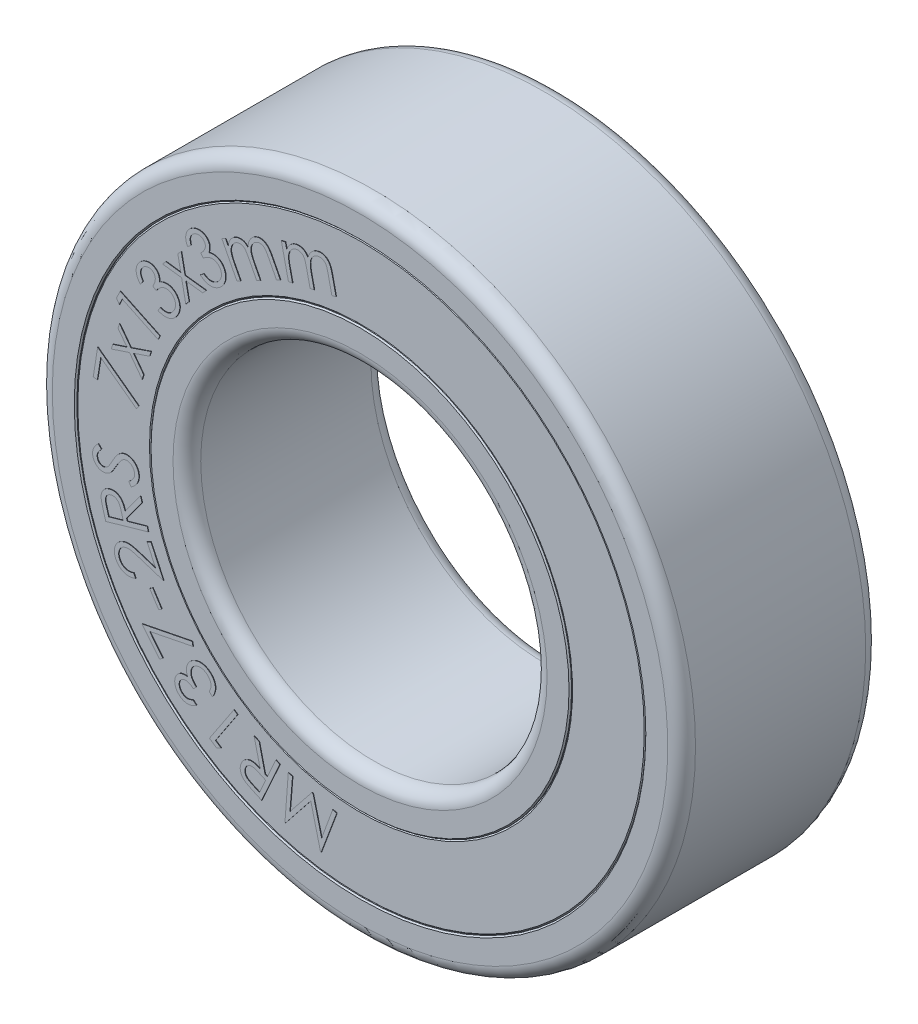
from build123d import *

# Parameters (mm, degrees)
SKETCH_R_INNER_BODY_W           = 4
SKETCH_R_INNER_BODY_H           = 0.75
FILLET_INNER_BODY_R             = 0.28
CHAMFER_INNER_BODY_SIZE         = 0.026
SKETCH_R_OUTER_BODY_W           = 4
SKETCH_R_OUTER_BODY_H           = 0.75
FILLET_OUTER_BODY_R             = 0.28
CHAMFER_OUTER_BODY_SIZE         = 0.026
SKETCH_R_SEAL_FACES_W           = 3.96
SKETCH_R_SEAL_FACES_H           = 1.5
CHAMFER_SEALS_SIZE              = 0.026
BOSS_EXTRUDE_SEAL_LABEL_1_DEPTH = 0.01
BOSS_EXTRUDE_SEAL_LABEL_2_DEPTH = 0.01


with BuildPart() as part:
    # Sketch R, INNER BODY → Revolve INNER BODY (revolve)
    with BuildSketch(Plane(origin=(0, 0, 0), x_dir=(0, 0, -1), z_dir=(1, 0, 0)), mode=Mode.PRIVATE) as revolve_inner_body_sk:
        with Locations((0, 3.875)):
            Rectangle(SKETCH_R_INNER_BODY_W, SKETCH_R_INNER_BODY_H)
    revolve(revolve_inner_body_sk.sketch.rotate(Axis((0, 0, 17.5), (0, 0, -1)), 90), axis=Axis((0, 0, 17.5), (0, 0, -1)))

    # Fillet INNER BODY
    fillet_inner_body_edges = [part.edges().sort_by_distance(p)[0] for p in [
        (-3.5, 0, -2),
        (-3.5, 0, 2),
    ]]
    fillet(fillet_inner_body_edges, radius=FILLET_INNER_BODY_R)

    # Chamfer INNER BODY
    chamfer_inner_body_edges = [part.edges().sort_by_distance(p)[0] for p in [
        (-4.25, 0, 2),
        (-4.25, 0, -2),
    ]]
    chamfer(chamfer_inner_body_edges, length=CHAMFER_INNER_BODY_SIZE)



with BuildPart() as body_2:
    # Sketch R, OUTER BODY → Revolve OUTER BODY (revolve)
    with BuildSketch(Plane(origin=(0, 0, 0), x_dir=(0, 0, -1), z_dir=(1, 0, 0)), mode=Mode.PRIVATE) as revolve_outer_body_sk:
        with Locations((0, 6.125)):
            Rectangle(SKETCH_R_OUTER_BODY_W, SKETCH_R_OUTER_BODY_H)
    revolve(revolve_outer_body_sk.sketch.rotate(Axis((0, 0, 17.5), (0, 0, -1)), 90), axis=Axis((0, 0, 17.5), (0, 0, -1)))

    # Fillet OUTER BODY
    fillet_outer_body_edges = [body_2.edges().sort_by_distance(p)[0] for p in [
        (-6.5, 0, 2),
        (-6.5, 0, -2),
    ]]
    fillet(fillet_outer_body_edges, radius=FILLET_OUTER_BODY_R)

    # Chamfer OUTER BODY
    chamfer_outer_body_edges = [body_2.edges().sort_by_distance(p)[0] for p in [
        (-5.75, 0, -2),
        (-5.75, 0, 2),
    ]]
    chamfer(chamfer_outer_body_edges, length=CHAMFER_OUTER_BODY_SIZE)


with BuildPart() as body_3:
    # Sketch R, SEAL FACES → Revolve SEALS (revolve)
    with BuildSketch(Plane(origin=(0, 0, 0), x_dir=(0, 0, -1), z_dir=(1, 0, 0)), mode=Mode.PRIVATE) as revolve_seals_sk:
        with Locations((0, 5)):
            Rectangle(SKETCH_R_SEAL_FACES_W, SKETCH_R_SEAL_FACES_H)
    revolve(revolve_seals_sk.sketch.rotate(Axis((0, 0, 17.5), (0, 0, -1)), 270), axis=Axis((0, 0, 17.5), (0, 0, -1)))

    # Chamfer SEALS
    chamfer_seals_edges = [body_3.edges().sort_by_distance(p)[0] for p in [
        (4.25, 0, -1.98),
        (4.25, 0, 1.98),
        (5.75, 0, 1.98),
        (5.75, 0, -1.98),
    ]]
    chamfer(chamfer_seals_edges, length=CHAMFER_SEALS_SIZE)


with BuildPart() as part_1:
    add(part.part)

    add(body_3.part)  # Boss-Extrude SEAL LABEL 1 merges body 3

    add(body_2.part)  # Boss-Extrude SEAL LABEL 1 merges body 2
    # Sketch TEXT RADIUS 1 — MANUALLY ASSIGN TEXT AND FONT SIZE (FROM EQUATIONS) → Boss-Extrude SEAL LABEL 1 (add)
    # profile 1 of 17: a face of its own
    with BuildSketch(Plane.XY.offset(1.98)):
        with BuildLine():
            Line((-1.601013432, 4.94242738), (-1.518801893, 4.960816803))
            Line((-1.518801893, 4.960816803), (-1.493922085, 4.849578822))
            add(Edge.make_bspline(
                [(-1.493922085, 4.849578822), (-1.488999401, 4.860846674), (-1.479582993, 4.882400498), (-1.463086551, 4.912024507), (-1.445404944, 4.937737324), (-1.431891768, 4.952362173), (-1.42541247, 4.959374495)],
                knots=[0, 0, 0, 0, 1.132709004, 2.166713762, 3.120975974, 4, 4, 4, 4], degree=3))
            add(Edge.make_bspline(
                [(-1.42541247, 4.959374495), (-1.416246773, 4.96751939), (-1.398219148, 4.983539242), (-1.367870433, 5.002617299), (-1.335924627, 5.017770953), (-1.313274299, 5.023665767), (-1.301914874, 5.026622091)],
                knots=[0, 0, 0, 0, 1.032308853, 2.030405018, 3.012223225, 4, 4, 4, 4], degree=3))
            add(Edge.make_bspline(
                [(-1.301914874, 5.026622091), (-1.294185656, 5.028103719), (-1.278818708, 5.031049437), (-1.255415447, 5.032626662), (-1.232096778, 5.031702192), (-1.209102002, 5.028430716), (-1.186955752, 5.023181002), (-1.166226801, 5.015651981), (-1.14692107, 5.006546969), (-1.129035777, 4.994906449), (-1.112123306, 4.980396587), (-1.095550511, 4.962835849), (-1.079263364, 4.941674752), (-1.069219552, 4.925984622), (-1.063934105, 4.917727861)],
                knots=[0, 0, 0, 0, 1.003572602, 1.995266442, 2.985298357, 3.976576977, 4.954956483, 5.884034433, 6.786134005, 7.673145202, 8.598131186, 9.623386984, 10.749333065, 12, 12, 12, 12], degree=3))
            add(Edge.make_bspline(
                [(-1.063934105, 4.917727861), (-1.059589396, 4.931382766), (-1.051148458, 4.957911639), (-1.033085576, 4.994586633), (-1.012132275, 5.027674577), (-0.986982868, 5.056160022), (-0.959271064, 5.080698233), (-0.928789378, 5.100461776), (-0.89618638, 5.11607427), (-0.872954015, 5.122176279), (-0.861289874, 5.12523988)],
                knots=[0, 0, 0, 0, 1.126544146, 2.188660152, 3.20822553, 4.200628457, 5.169445145, 6.112854147, 7.052531474, 8, 8, 8, 8], degree=3))
            add(Edge.make_bspline(
                [(-0.861289874, 5.12523988), (-0.850332234, 5.127332368), (-0.828906174, 5.131423922), (-0.796599568, 5.131542643), (-0.765359818, 5.127490944), (-0.735394801, 5.118588685), (-0.707211169, 5.105395348), (-0.681178451, 5.088153164), (-0.658220571, 5.066281821), (-0.641103692, 5.045080279), (-0.628837588, 5.025523229), (-0.61960587, 5.008794201), (-0.611003667, 4.989886294), (-0.602705788, 4.968944394), (-0.594940508, 4.945891817), (-0.587037623, 4.920959854), (-0.579907297, 4.893855244), (-0.575598381, 4.875012204), (-0.573369201, 4.865263918)],
                knots=[0, 0, 0, 0, 1.210133272, 2.366238299, 3.493139177, 4.623573824, 5.748485634, 6.864335867, 8.001036068, 9.181187922, 9.815358496, 10.508102159, 11.256208296, 12.07122873, 12.95524251, 13.899296218, 14.91321886, 16, 16, 16, 16], degree=3))
            Line((-0.573369201, 4.865263918), (-0.494763432, 4.513881707))
            Line((-0.494763432, 4.513881707), (-0.57931872, 4.495131707))
            Line((-0.57931872, 4.495131707), (-0.657924489, 4.846513918))
            add(Edge.make_bspline(
                [(-0.657924489, 4.846513918), (-0.659806895, 4.854816799), (-0.66340387, 4.870682273), (-0.669214618, 4.893336278), (-0.674993971, 4.913889569), (-0.680579989, 4.932434565), (-0.686650963, 4.948648968), (-0.692305156, 4.962891834), (-0.698247842, 4.974891497), (-0.705842178, 4.988186826), (-0.71676623, 5.002169511), (-0.731893919, 5.016513892), (-0.749447387, 5.028097345), (-0.768949328, 5.037104052), (-0.790089576, 5.043260747), (-0.812515868, 5.046134457), (-0.836057434, 5.045635671), (-0.851764948, 5.042604776), (-0.859847566, 5.041045168)],
                knots=[0, 0, 0, 0, 1.265094215, 2.417392459, 3.474805909, 4.438006383, 5.294067851, 6.046980395, 6.713956198, 7.28221309, 8.320023727, 9.337187848, 10.367556122, 11.430386069, 12.518466311, 13.626159726, 14.778492576, 16, 16, 16, 16], degree=3))
            add(Edge.make_bspline(
                [(-0.859847566, 5.041045168), (-0.869628694, 5.038404434), (-0.888950211, 5.03318796), (-0.916059628, 5.020034104), (-0.940785297, 5.002718237), (-0.962881786, 4.981456335), (-0.981667769, 4.95703514), (-0.996987706, 4.930154634), (-1.00785152, 4.900912283), (-1.013952054, 4.874769772), (-1.016259263, 4.851965803), (-1.01671638, 4.832327528), (-1.015943701, 4.810422046), (-1.013881977, 4.786187243), (-1.010659916, 4.759652392), (-1.00582252, 4.730895595), (-1.000097284, 4.699738571), (-0.995483188, 4.678293061), (-0.993080739, 4.667126899)],
                knots=[0, 0, 0, 0, 1.079561089, 2.132551357, 3.196736933, 4.290141178, 5.392316786, 6.475227011, 7.579659096, 8.711017914, 9.330173797, 10.023242848, 10.806272841, 11.668751668, 12.618775025, 13.658611123, 14.780895041, 16, 16, 16, 16], degree=3))
            Line((-0.993080739, 4.667126899), (-0.936650451, 4.41508363))
            Line((-0.936650451, 4.41508363), (-1.018861989, 4.396694207))
            Line((-1.018861989, 4.396694207), (-1.09259997, 4.726261515))
            add(Edge.make_bspline(
                [(-1.09259997, 4.726261515), (-1.094736784, 4.73558263), (-1.098824471, 4.753413764), (-1.105114187, 4.778920079), (-1.111380734, 4.801956971), (-1.117629417, 4.822543939), (-1.123994074, 4.840605994), (-1.130032959, 4.856367903), (-1.136095572, 4.869688927), (-1.143962099, 4.884108237), (-1.15489101, 4.89940796), (-1.170506309, 4.914715673), (-1.188152751, 4.927505741), (-1.207876949, 4.937391821), (-1.22918814, 4.944350311), (-1.251857967, 4.947544956), (-1.275528267, 4.947209057), (-1.291306302, 4.944285806), (-1.299390835, 4.942787957)],
                knots=[0, 0, 0, 0, 1.335810419, 2.5553822, 3.669347715, 4.67042929, 5.559830211, 6.343958493, 7.027597223, 7.602433961, 8.636855363, 9.640046553, 10.644220713, 11.669128891, 12.709798989, 13.761649994, 14.853088174, 16, 16, 16, 16], degree=3))
            add(Edge.make_bspline(
                [(-1.299390835, 4.942787957), (-1.308758488, 4.940276435), (-1.327389144, 4.935281448), (-1.353413259, 4.922174108), (-1.37775411, 4.905447748), (-1.399631469, 4.884606388), (-1.418807408, 4.860751904), (-1.434072641, 4.834066687), (-1.445503213, 4.805177559), (-1.451656412, 4.779325236), (-1.454570231, 4.757035312), (-1.455378417, 4.738346766), (-1.454932244, 4.71788643), (-1.453446718, 4.695694307), (-1.450947068, 4.671746305), (-1.447070708, 4.646018873), (-1.442025698, 4.618552166), (-1.437963492, 4.599688628), (-1.435869201, 4.589963438)],
                knots=[0, 0, 0, 0, 1.087498972, 2.162849092, 3.255119655, 4.397047257, 5.545746028, 6.68341116, 7.838545269, 9.026235708, 9.659577299, 10.362818237, 11.12615456, 11.958667977, 12.861930403, 13.831448191, 14.881992405, 16, 16, 16, 16], degree=3))
            Line((-1.435869201, 4.589963438), (-1.374931701, 4.317186995))
            Line((-1.374931701, 4.317186995), (-1.457143239, 4.298797572))
            Line((-1.457143239, 4.298797572), (-1.601013432, 4.94242738))
        make_face()
    # profile 2 of 17: a face of its own
    with BuildSketch(Plane.XY.offset(1.98)):
        with BuildLine():
            Line((-2.803042046, 4.37741434), (-2.727861758, 4.416176359))
            Line((-2.727861758, 4.416176359), (-2.675397816, 4.314493667))
            add(Edge.make_bspline(
                [(-2.675397816, 4.314493667), (-2.673515942, 4.326678185), (-2.669897407, 4.350107014), (-2.661159676, 4.383083901), (-2.650637752, 4.412684433), (-2.641174419, 4.430275653), (-2.636635796, 4.438712417)],
                knots=[0, 0, 0, 0, 1.129273917, 2.171408526, 3.123006008, 4, 4, 4, 4], degree=3))
            add(Edge.make_bspline(
                [(-2.636635796, 4.438712417), (-2.629888625, 4.448967417), (-2.616608396, 4.469151984), (-2.591953859, 4.495379791), (-2.564781252, 4.518217298), (-2.544290963, 4.529759508), (-2.534051662, 4.535527321)],
                knots=[0, 0, 0, 0, 1.029964064, 2.027243269, 3.01418423, 4, 4, 4, 4], degree=3))
            add(Edge.make_bspline(
                [(-2.534051662, 4.535527321), (-2.526898767, 4.538909783), (-2.512680885, 4.545633139), (-2.490408786, 4.553244304), (-2.467543377, 4.558276471), (-2.444402537, 4.560979265), (-2.421522527, 4.561281719), (-2.399362199, 4.559668795), (-2.378347015, 4.555206624), (-2.357942235, 4.548648362), (-2.337813277, 4.53900218), (-2.317253874, 4.526131512), (-2.295991957, 4.50984403), (-2.282205884, 4.497124634), (-2.274977143, 4.490455206)],
                knots=[0, 0, 0, 0, 1.004678336, 1.997009522, 2.982473485, 3.974011335, 4.951397589, 5.885978984, 6.790384156, 7.674055595, 8.603006554, 9.617873795, 10.750929726, 12, 12, 12, 12], degree=3))
            add(Edge.make_bspline(
                [(-2.274977143, 4.490455206), (-2.274691187, 4.497730967), (-2.27412762, 4.512070197), (-2.272006768, 4.533219904), (-2.26846201, 4.553583698), (-2.264290975, 4.573273663), (-2.258620899, 4.592179839), (-2.251762902, 4.610260316), (-2.244003854, 4.627789322), (-2.232057803, 4.649822742), (-2.215029205, 4.675597316), (-2.190275231, 4.702383105), (-2.162660501, 4.725869463), (-2.14166254, 4.737655442), (-2.13110695, 4.743580206)],
                knots=[0, 0, 0, 0, 0.855969267, 1.686962932, 2.49656552, 3.285146425, 4.051901859, 4.814348176, 5.55756449, 6.303596535, 7.759592603, 9.17495839, 10.579863116, 12, 12, 12, 12], degree=3))
            add(Edge.make_bspline(
                [(-2.13110695, 4.743580206), (-2.121007779, 4.748322703), (-2.101234223, 4.75760822), (-2.069973676, 4.766323495), (-2.038547741, 4.770140838), (-2.007187238, 4.769234948), (-1.976444254, 4.763704646), (-1.946929209, 4.753235986), (-1.918823489, 4.738274293), (-1.896918677, 4.721879587), (-1.879746776, 4.706298023), (-1.866882848, 4.692013548), (-1.853429088, 4.6760599), (-1.84024947, 4.657666327), (-1.826417951, 4.637560531), (-1.812843814, 4.615027151), (-1.798725971, 4.590654053), (-1.789753388, 4.573425018), (-1.785133393, 4.564553763)],
                knots=[0, 0, 0, 0, 1.206035824, 2.361343885, 3.494931086, 4.620727732, 5.744775355, 6.861875256, 7.996768111, 9.178061744, 9.813402514, 10.503890231, 11.256788531, 12.07123776, 12.951668653, 13.897705946, 14.917525833, 16, 16, 16, 16], degree=3))
            Line((-1.785133393, 4.564553763), (-1.619268008, 4.243279725))
            Line((-1.619268008, 4.243279725), (-1.696611758, 4.203435975))
            Line((-1.696611758, 4.203435975), (-1.862477143, 4.524710013))
            add(Edge.make_bspline(
                [(-1.862477143, 4.524710013), (-1.866391181, 4.532310286), (-1.873902731, 4.546896198), (-1.885499142, 4.567359312), (-1.89631228, 4.585851915), (-1.906558067, 4.602328631), (-1.91640031, 4.616726948), (-1.925770094, 4.628965554), (-1.934412382, 4.639285175), (-1.945382212, 4.649949485), (-1.959411924, 4.660932882), (-1.977887444, 4.670693273), (-1.997801613, 4.677704772), (-2.019050287, 4.681318469), (-2.041110837, 4.682207059), (-2.063605708, 4.679135853), (-2.086283193, 4.672662734), (-2.100783734, 4.665790027), (-2.108210316, 4.662270109)],
                knots=[0, 0, 0, 0, 1.265571299, 2.428796095, 3.481710968, 4.437103545, 5.300892981, 6.062550861, 6.718796846, 7.29135529, 8.325340921, 9.344365052, 10.371436882, 11.437836607, 12.523912924, 13.627523768, 14.784915091, 16, 16, 16, 16], degree=3))
            add(Edge.make_bspline(
                [(-2.108210316, 4.662270109), (-2.117039007, 4.657183903), (-2.134488766, 4.647131103), (-2.157533289, 4.627488117), (-2.17696063, 4.604193224), (-2.193113053, 4.577992249), (-2.20537865, 4.549518514), (-2.212958535, 4.519379852), (-2.21646427, 4.488264393), (-2.215434233, 4.46133281), (-2.211733833, 4.438660756), (-2.207414308, 4.419475265), (-2.200993416, 4.398449825), (-2.192763288, 4.375454602), (-2.182922086, 4.350525481), (-2.171054476, 4.323682852), (-2.157380143, 4.294989875), (-2.147433382, 4.275290982), (-2.142284835, 4.265094629)],
                knots=[0, 0, 0, 0, 1.081417697, 2.137403784, 3.198267252, 4.293912398, 5.398626796, 6.480101097, 7.585554063, 8.717148334, 9.331545179, 10.025833452, 10.805978184, 11.666702905, 12.621647132, 13.65426469, 14.785822897, 16, 16, 16, 16], degree=3))
            Line((-2.142284835, 4.265094629), (-2.02329445, 4.034685975))
            Line((-2.02329445, 4.034685975), (-2.098474739, 3.995923956))
            Line((-2.098474739, 3.995923956), (-2.254063681, 4.297185975))
            add(Edge.make_bspline(
                [(-2.254063681, 4.297185975), (-2.258470165, 4.305680948), (-2.266927102, 4.321984526), (-2.279711551, 4.345048625), (-2.291916772, 4.365732112), (-2.302775763, 4.384447567), (-2.313822763, 4.4002433), (-2.323618209, 4.41402446), (-2.332766627, 4.425520179), (-2.344156054, 4.437378092), (-2.358726204, 4.449377492), (-2.377625459, 4.460516089), (-2.398100748, 4.468351713), (-2.419827495, 4.472837056), (-2.442347065, 4.473946855), (-2.465141584, 4.471315173), (-2.488070317, 4.465191381), (-2.502595015, 4.458304114), (-2.510073296, 4.45475809)],
                knots=[0, 0, 0, 0, 1.331429695, 2.555283997, 3.668110919, 4.673301256, 5.563839167, 6.348235065, 7.025957696, 7.605480864, 8.633230104, 9.641337263, 10.644438962, 11.669327283, 12.715682269, 13.767368696, 14.850492803, 16, 16, 16, 16], degree=3))
            add(Edge.make_bspline(
                [(-2.510073296, 4.45475809), (-2.518474299, 4.449899659), (-2.53522866, 4.440210349), (-2.557435036, 4.42113894), (-2.576524681, 4.398382363), (-2.592578995, 4.372663573), (-2.605053978, 4.344582615), (-2.613234176, 4.314870741), (-2.617071235, 4.283895195), (-2.616330818, 4.257188704), (-2.613577919, 4.234728434), (-2.609428276, 4.216410386), (-2.603987198, 4.1966077), (-2.596956249, 4.175422394), (-2.588187111, 4.152788099), (-2.5779104, 4.128762872), (-2.566217029, 4.103196101), (-2.5573791, 4.085973753), (-2.552801662, 4.077053763)],
                knots=[0, 0, 0, 0, 1.083931526, 2.161715825, 3.254100199, 4.395749721, 5.542554245, 6.679403148, 7.831006039, 9.021286838, 9.658380756, 10.359899608, 11.119959312, 11.955483923, 12.855692869, 13.834696785, 14.8785222, 16, 16, 16, 16], degree=3))
            Line((-2.552801662, 4.077053763), (-2.4240757, 3.827714821))
            Line((-2.4240757, 3.827714821), (-2.499255989, 3.788952802))
            Line((-2.499255989, 3.788952802), (-2.803042046, 4.37741434))
        make_face()
    # profile 3 of 17: a face of its own
    with BuildSketch(Plane.XY.offset(1.98)):
        with BuildLine():
            Line((-3.425679523, 3.949798936), (-3.496532888, 3.892467205))
            add(Edge.make_bspline(
                [(-3.496532888, 3.892467205), (-3.50050429, 3.900826441), (-3.508280353, 3.917193946), (-3.51762179, 3.942246649), (-3.525071063, 3.966857816), (-3.530382571, 3.991205569), (-3.533474762, 4.015156212), (-3.534343836, 4.03880395), (-3.533341948, 4.06210201), (-3.530039756, 4.085022815), (-3.524856005, 4.107284925), (-3.517784807, 4.12870332), (-3.508909781, 4.149154417), (-3.498292372, 4.16868967), (-3.485712046, 4.187109558), (-3.471604308, 4.204759993), (-3.455517213, 4.221390767), (-3.443616005, 4.231506301), (-3.437578561, 4.236637878)],
                knots=[0, 0, 0, 0, 1.168181649, 2.28731676, 3.372541074, 4.412981288, 5.430502677, 6.417775536, 7.397788506, 8.371197619, 9.337600281, 10.280719979, 11.215405789, 12.149321105, 13.083852867, 14.028436943, 14.999832431, 16, 16, 16, 16], degree=3))
            add(Edge.make_bspline(
                [(-3.437578561, 4.236637878), (-3.428429364, 4.243559423), (-3.41026039, 4.257304604), (-3.380228171, 4.273383641), (-3.348839329, 4.286074924), (-3.316133519, 4.294364062), (-3.283170387, 4.298989415), (-3.250663052, 4.299231429), (-3.219044909, 4.295053296), (-3.188773155, 4.286558262), (-3.160321479, 4.27450357), (-3.134288634, 4.259380979), (-3.111174202, 4.240813069), (-3.098256505, 4.226139933), (-3.091785292, 4.218789321)],
                knots=[0, 0, 0, 0, 1.074185811, 2.133176607, 3.182606063, 4.241716767, 5.28798015, 6.296561443, 7.279897109, 8.268256398, 9.235232785, 10.169684628, 11.083090461, 12, 12, 12, 12], degree=3))
            add(Edge.make_bspline(
                [(-3.091785292, 4.218789321), (-3.086090128, 4.211246613), (-3.074912627, 4.196443066), (-3.062231739, 4.171955138), (-3.053360856, 4.146503981), (-3.047916604, 4.11994395), (-3.046876671, 4.092242853), (-3.049265563, 4.063490711), (-3.055429258, 4.033691255), (-3.062285059, 4.014032532), (-3.065823753, 4.003885474)],
                knots=[0, 0, 0, 0, 0.995340814, 1.953486099, 2.893539367, 3.830704074, 4.801385554, 5.806124921, 6.867608226, 8, 8, 8, 8], degree=3))
            add(Edge.make_bspline(
                [(-3.065823753, 4.003885474), (-3.05476632, 4.006891373), (-3.033068837, 4.012789707), (-2.999823903, 4.01637446), (-2.967014428, 4.016324342), (-2.945602689, 4.012715048), (-2.93493433, 4.010916724)],
                knots=[0, 0, 0, 0, 1.037062692, 2.034979485, 3.020932209, 4, 4, 4, 4], degree=3))
            add(Edge.make_bspline(
                [(-2.93493433, 4.010916724), (-2.927566361, 4.009245936), (-2.913021246, 4.005947631), (-2.89208889, 3.99876929), (-2.87213117, 3.990349481), (-2.853300496, 3.980204807), (-2.835535664, 3.968388114), (-2.818812233, 3.955080971), (-2.803113998, 3.940232267), (-2.793788919, 3.929217922), (-2.789080965, 3.923657109)],
                knots=[0, 0, 0, 0, 1.044568202, 2.062082874, 3.056647268, 4.038726437, 5.016467046, 6.004616178, 6.992590401, 8, 8, 8, 8], degree=3))
            add(Edge.make_bspline(
                [(-2.789080965, 3.923657109), (-2.781510206, 3.913576241), (-2.766438887, 3.893507977), (-2.749089641, 3.859768671), (-2.736265178, 3.823680214), (-2.728059447, 3.785622834), (-2.724580942, 3.746735133), (-2.726286112, 3.708004186), (-2.733695589, 3.670046912), (-2.746157942, 3.63314675), (-2.76347633, 3.597697935), (-2.785686034, 3.564555218), (-2.812399444, 3.533697639), (-2.833137501, 3.51566264), (-2.843708369, 3.506469609)],
                knots=[0, 0, 0, 0, 0.967030314, 1.925094047, 2.900462496, 3.901897674, 4.907473884, 5.891835301, 6.869625945, 7.868141512, 8.875644378, 9.890953745, 10.92494992, 12, 12, 12, 12], degree=3))
            add(Edge.make_bspline(
                [(-2.843708369, 3.506469609), (-2.851201394, 3.500711439), (-2.865940186, 3.489385108), (-2.889025594, 3.474552586), (-2.912577153, 3.462230677), (-2.936461356, 3.4522702), (-2.960744089, 3.444538229), (-2.985493562, 3.439644362), (-3.010566334, 3.43659524), (-3.035945206, 3.436273333), (-3.061463564, 3.438514368), (-3.087034028, 3.442967265), (-3.112527281, 3.450224821), (-3.137775388, 3.460288647), (-3.163074277, 3.472630305), (-3.188225329, 3.487649493), (-3.213392443, 3.505135218), (-3.229439261, 3.518427626), (-3.237638657, 3.525219609)],
                knots=[0, 0, 0, 0, 1.045864225, 2.057216695, 3.033290936, 3.984678341, 4.918953529, 5.849264324, 6.773536787, 7.711712439, 8.653184903, 9.605897345, 10.580996112, 11.581723197, 12.611228957, 13.694043653, 14.821732209, 16, 16, 16, 16], degree=3))
            Line((-3.237638657, 3.525219609), (-3.169489619, 3.580387878))
            add(Edge.make_bspline(
                [(-3.169489619, 3.580387878), (-3.163515431, 3.576188694), (-3.151906768, 3.568029106), (-3.134431898, 3.557022754), (-3.11740545, 3.547488208), (-3.100730561, 3.539814648), (-3.084534544, 3.533586436), (-3.068886977, 3.528852288), (-3.053613083, 3.525683641), (-3.043540402, 3.524767496), (-3.038600196, 3.524318167)],
                knots=[0, 0, 0, 0, 1.214590435, 2.360114797, 3.434042068, 4.458337535, 5.410789615, 6.318541787, 7.175318919, 8, 8, 8, 8], degree=3))
            add(Edge.make_bspline(
                [(-3.038600196, 3.524318167), (-3.032466242, 3.524188572), (-3.020228774, 3.523930024), (-3.001932843, 3.525864834), (-2.983773327, 3.529384184), (-2.966019171, 3.5351651), (-2.948317363, 3.542058337), (-2.931146821, 3.55134011), (-2.913969661, 3.562016115), (-2.903130096, 3.570488133), (-2.897614619, 3.574798936)],
                knots=[0, 0, 0, 0, 0.960139297, 1.915514064, 2.875468771, 3.851987477, 4.836098631, 5.846641031, 6.904310009, 8, 8, 8, 8], degree=3))
            add(Edge.make_bspline(
                [(-2.897614619, 3.574798936), (-2.891574586, 3.57992816), (-2.879733078, 3.589984023), (-2.863883726, 3.606422295), (-2.85006848, 3.623488331), (-2.838177351, 3.641115389), (-2.828908245, 3.659715462), (-2.821147384, 3.678686311), (-2.8157144, 3.698479116), (-2.812631217, 3.718752738), (-2.811096243, 3.738956032), (-2.81164603, 3.758707412), (-2.814054462, 3.777695467), (-2.817875456, 3.7961507), (-2.82417401, 3.813761593), (-2.831910443, 3.830828072), (-2.841511165, 3.847264073), (-2.849302658, 3.85739103), (-2.853263657, 3.862539321)],
                knots=[0, 0, 0, 0, 1.169589122, 2.292983976, 3.365708583, 4.409295917, 5.425314445, 6.428893767, 7.432159153, 8.447596179, 9.452900405, 10.420563857, 11.359478393, 12.276797996, 13.197331387, 14.11465099, 15.04153605, 16, 16, 16, 16], degree=3))
            add(Edge.make_bspline(
                [(-2.853263657, 3.862539321), (-2.858959972, 3.86904633), (-2.870274193, 3.88197078), (-2.890644312, 3.897838682), (-2.913139745, 3.910867661), (-2.937714508, 3.920566251), (-2.963423085, 3.927377282), (-2.98980141, 3.929989629), (-3.01634283, 3.929212287), (-3.038535551, 3.92495336), (-3.056829509, 3.919751227), (-3.071577622, 3.914015589), (-3.087380693, 3.907057576), (-3.10411227, 3.898402152), (-3.121827212, 3.888413907), (-3.140436976, 3.876721271), (-3.160162649, 3.863774469), (-3.173428688, 3.854293829), (-3.180306926, 3.849378263)],
                knots=[0, 0, 0, 0, 1.128386011, 2.241240002, 3.357001971, 4.516812585, 5.684869124, 6.82229893, 7.969992605, 9.144189017, 9.765781526, 10.454498111, 11.210706197, 12.022343241, 12.915927263, 13.868616195, 14.894910105, 16, 16, 16, 16], degree=3))
            Line((-3.180306926, 3.849378263), (-3.232049715, 3.913200378))
            add(Edge.make_bspline(
                [(-3.232049715, 3.913200378), (-3.224394556, 3.919656985), (-3.209322786, 3.932369), (-3.189551918, 3.953755088), (-3.172416478, 3.976248603), (-3.158256836, 3.999645131), (-3.147374155, 4.023264998), (-3.139469132, 4.046105023), (-3.135822918, 4.068160823), (-3.135509531, 4.08911017), (-3.138787109, 4.108919909), (-3.144219517, 4.1276706), (-3.152855409, 4.145135285), (-3.160549885, 4.155496178), (-3.164441542, 4.160736436)],
                knots=[0, 0, 0, 0, 1.260961835, 2.482629811, 3.660999322, 4.81949029, 5.920699942, 6.933695977, 7.854987388, 8.72591172, 9.561344388, 10.375922703, 11.178585944, 12, 12, 12, 12], degree=3))
            add(Edge.make_bspline(
                [(-3.164441542, 4.160736436), (-3.167562104, 4.1643401), (-3.173774069, 4.171513756), (-3.184150189, 4.181154084), (-3.195711224, 4.188938305), (-3.207640401, 4.196105252), (-3.22074578, 4.20127421), (-3.234454823, 4.205861301), (-3.249168983, 4.208303617), (-3.264392982, 4.210056806), (-3.279911329, 4.210178557), (-3.295383023, 4.208984906), (-3.310527875, 4.206037021), (-3.325511588, 4.201673061), (-3.340232174, 4.195721281), (-3.354717994, 4.188218854), (-3.369071853, 4.179462196), (-3.378030126, 4.172429569), (-3.38259058, 4.168849417)],
                knots=[0, 0, 0, 0, 0.941832065, 1.874863526, 2.787416533, 3.69181985, 4.618100842, 5.564563305, 6.542825064, 7.557876345, 8.59110416, 9.603930058, 10.619398055, 11.634032448, 12.683712785, 13.751244295, 14.855209233, 16, 16, 16, 16], degree=3))
            add(Edge.make_bspline(
                [(-3.38259058, 4.168849417), (-3.389599232, 4.162693556), (-3.403312883, 4.150648539), (-3.419885705, 4.129206024), (-3.43239431, 4.10581865), (-3.439110454, 4.084727991), (-3.442545411, 4.066964504), (-3.443745768, 4.052709036), (-3.443724461, 4.037573751), (-3.442391192, 4.021618683), (-3.440017181, 4.00483159), (-3.436605896, 3.987163673), (-3.431680806, 3.968728463), (-3.427713207, 3.956213676), (-3.425679523, 3.949798936)],
                knots=[0, 0, 0, 0, 1.395500561, 2.730540285, 4.036024168, 5.351968182, 6.030307938, 6.744647138, 7.492226412, 8.296323188, 9.142116423, 10.032396064, 10.991459616, 12, 12, 12, 12], degree=3))
        make_face()
    # profile 4 of 17: a face of its own
    with BuildSketch(Plane.XY.offset(1.98)):
        Polygon((-4.000864048, 3.335343908), (-3.931272702, 3.41016362), (-3.63271501, 3.371581889), (-3.693111644, 3.666533812), (-3.623520298, 3.741353524), (-3.547438568, 3.361846312), (-3.119794337, 3.312266985), (-3.190106837, 3.236545831), (-3.531212606, 3.277291024), (-3.463604433, 2.942315062), (-3.532654914, 2.868036216), (-3.616489048, 3.287567466), align=None)
    # profile 5 of 17: a face of its own
    with BuildSketch(Plane.XY.offset(1.98)):
        with BuildLine():
            Line((-4.396040593, 2.833296229), (-4.448324247, 2.758115941))
            add(Edge.make_bspline(
                [(-4.448324247, 2.758115941), (-4.454492001, 2.765065457), (-4.466557622, 2.778660393), (-4.482656415, 2.800046863), (-4.496647427, 2.821707818), (-4.508317963, 2.843783236), (-4.518227424, 2.865927522), (-4.525585966, 2.888500545), (-4.531062184, 2.911214848), (-4.534337813, 2.934158614), (-4.535292293, 2.956965255), (-4.534737268, 2.979542039), (-4.531705429, 3.001656006), (-4.527151566, 3.023440479), (-4.520121746, 3.044690405), (-4.511281922, 3.065526559), (-4.500675026, 3.086150048), (-4.492024143, 3.099119879), (-4.487627131, 3.105712095)],
                knots=[0, 0, 0, 0, 1.170875899, 2.290516958, 3.370609084, 4.417790128, 5.43539982, 6.424759294, 7.405935483, 8.37762013, 9.34076285, 10.280595047, 11.220213511, 12.150348232, 13.08223964, 14.036162607, 15.001834241, 16, 16, 16, 16], degree=3))
            add(Edge.make_bspline(
                [(-4.487627131, 3.105712095), (-4.480763034, 3.114976635), (-4.467161896, 3.133334226), (-4.442909677, 3.157350251), (-4.416120999, 3.178127679), (-4.387101676, 3.195447198), (-4.356614774, 3.209245861), (-4.325304635, 3.218495003), (-4.293628518, 3.22329858), (-4.262108204, 3.22352961), (-4.231273935, 3.220103615), (-4.202058899, 3.212342012), (-4.174417745, 3.201375694), (-4.157855321, 3.190839998), (-4.149586266, 3.185579883)],
                knots=[0, 0, 0, 0, 1.076292036, 2.132661559, 3.177426646, 4.237893903, 5.283730227, 6.2966878, 7.279216888, 8.267747063, 9.234678433, 10.169161612, 11.085924632, 12, 12, 12, 12], degree=3))
            add(Edge.make_bspline(
                [(-4.149586266, 3.185579883), (-4.142013512, 3.179900118), (-4.127186388, 3.168779384), (-4.108271028, 3.148698141), (-4.092423641, 3.126833708), (-4.079939568, 3.102668014), (-4.07126799, 3.076278459), (-4.065408048, 3.047923677), (-4.06310789, 3.017451442), (-4.064139113, 2.996575563), (-4.0646704, 2.985820268)],
                knots=[0, 0, 0, 0, 0.994328738, 1.946852507, 2.889101913, 3.82790864, 4.795608465, 5.80246181, 6.867823889, 8, 8, 8, 8], degree=3))
            add(Edge.make_bspline(
                [(-4.0646704, 2.985820268), (-4.054898953, 2.991808163), (-4.03571972, 3.003561103), (-4.004786581, 3.01621895), (-3.973265973, 3.025534828), (-3.951629536, 3.027904675), (-3.940812227, 3.029089499)],
                knots=[0, 0, 0, 0, 1.035866468, 2.033181427, 3.016673489, 4, 4, 4, 4], degree=3))
            add(Edge.make_bspline(
                [(-3.940812227, 3.029089499), (-3.933241657, 3.029524454), (-3.91828048, 3.030384026), (-3.89603917, 3.029320913), (-3.874354193, 3.026966992), (-3.853366207, 3.022381499), (-3.832992676, 3.015999766), (-3.813190635, 3.007904232), (-3.793950312, 2.998017433), (-3.781907861, 2.990023155), (-3.775848285, 2.986000556)],
                knots=[0, 0, 0, 0, 1.04512404, 2.065403774, 3.066722979, 4.050218458, 5.022756994, 6.007787877, 6.997549496, 8, 8, 8, 8], degree=3))
            add(Edge.make_bspline(
                [(-3.775848285, 2.986000556), (-3.765762452, 2.978396952), (-3.745650484, 2.96323475), (-3.719508826, 2.935582604), (-3.697325188, 2.904236906), (-3.678574873, 2.870011603), (-3.664463178, 2.833521944), (-3.655171113, 2.795718417), (-3.651675919, 2.757096591), (-3.653290133, 2.717987253), (-3.660239121, 2.679112145), (-3.671956268, 2.640848193), (-3.689285008, 2.603777278), (-3.704234454, 2.580609038), (-3.711845881, 2.568813056)],
                knots=[0, 0, 0, 0, 0.966183541, 1.926648278, 2.899998381, 3.901078812, 4.908068237, 5.888316388, 6.873093364, 7.868229715, 8.877772461, 9.889673649, 10.925539011, 12, 12, 12, 12], degree=3))
            add(Edge.make_bspline(
                [(-3.711845881, 2.568813056), (-3.717440204, 2.561150966), (-3.728410601, 2.546125701), (-3.746550332, 2.525489093), (-3.765689314, 2.506984568), (-3.785946701, 2.490756256), (-3.80707953, 2.476504421), (-3.829472219, 2.464826866), (-3.852742976, 2.45495298), (-3.877117059, 2.447623959), (-3.902287577, 2.442552721), (-3.928178538, 2.43984014), (-3.954760372, 2.43959944), (-3.981922786, 2.442387925), (-4.009779572, 2.446901105), (-4.038178914, 2.454510862), (-4.067265164, 2.464416526), (-4.086535717, 2.472650569), (-4.09640117, 2.476865941)],
                knots=[0, 0, 0, 0, 1.04712758, 2.053404135, 3.029561494, 3.982989994, 4.916088486, 5.839247623, 6.767235542, 7.703466945, 8.644366457, 9.598487469, 10.573967959, 11.573659152, 12.610029336, 13.686783683, 14.815761694, 16, 16, 16, 16], degree=3))
            Line((-4.09640117, 2.476865941), (-4.046100689, 2.549161614))
            add(Edge.make_bspline(
                [(-4.046100689, 2.549161614), (-4.039209884, 2.546757494), (-4.025763785, 2.542066311), (-4.005881833, 2.536249476), (-3.986765431, 2.532100572), (-3.968588961, 2.529199299), (-3.951246513, 2.527477473), (-3.934783581, 2.527296324), (-3.919179293, 2.528424069), (-3.909245695, 2.530486176), (-3.904393958, 2.531493345)],
                knots=[0, 0, 0, 0, 1.210109745, 2.361299545, 3.432458259, 4.45149818, 5.412355846, 6.31924719, 7.179091842, 8, 8, 8, 8], degree=3))
            add(Edge.make_bspline(
                [(-3.904393958, 2.531493345), (-3.898468072, 2.533123606), (-3.886609496, 2.536385999), (-3.86951927, 2.543291029), (-3.853109072, 2.551795929), (-3.837653096, 2.562181897), (-3.822701404, 2.573990416), (-3.808444244, 2.587497334), (-3.795139081, 2.60289089), (-3.787009831, 2.6140067), (-3.782879535, 2.619654403)],
                knots=[0, 0, 0, 0, 0.959750837, 1.920603675, 2.874085781, 3.842981663, 4.825615025, 5.848569837, 6.906905023, 8, 8, 8, 8], degree=3))
            add(Edge.make_bspline(
                [(-3.782879535, 2.619654403), (-3.778491074, 2.626251214), (-3.769886509, 2.639185748), (-3.759298999, 2.659453637), (-3.750708643, 2.679748237), (-3.744331549, 2.700086063), (-3.740405792, 2.720535673), (-3.73828513, 2.740937875), (-3.738721911, 2.761501389), (-3.741289983, 2.781887026), (-3.74554564, 2.801746461), (-3.751508818, 2.820652058), (-3.759146689, 2.83835862), (-3.768111857, 2.855051569), (-3.778817921, 2.87047465), (-3.791214195, 2.884611634), (-3.805107701, 2.897664068), (-3.815373827, 2.905326797), (-3.820559824, 2.909197672)],
                knots=[0, 0, 0, 0, 1.166287851, 2.286769879, 3.361862911, 4.408935549, 5.419222517, 6.424144472, 7.42449529, 8.441121255, 9.446316037, 10.412079066, 11.355809386, 12.2826187, 13.198458463, 14.114383766, 15.047469465, 16, 16, 16, 16], degree=3))
            add(Edge.make_bspline(
                [(-3.820559824, 2.909197672), (-3.82782512, 2.913819207), (-3.84233473, 2.923048929), (-3.866385431, 2.932690552), (-3.891766231, 2.938873649), (-3.918153098, 2.94150582), (-3.944806886, 2.940727798), (-3.970950538, 2.935898014), (-3.996241099, 2.927582588), (-4.016489259, 2.917386551), (-4.032565948, 2.907110337), (-4.045120213, 2.897464602), (-4.058280434, 2.886256011), (-4.072025135, 2.873409309), (-4.086246127, 2.858758371), (-4.100970294, 2.842392885), (-4.116166505, 2.824231928), (-4.126299334, 2.811445654), (-4.13155742, 2.804810653)],
                knots=[0, 0, 0, 0, 1.121007133, 2.238776653, 3.360304223, 4.518397237, 5.686840002, 6.825974875, 7.973490989, 9.147676167, 9.771630645, 10.459769074, 11.210410426, 12.02554667, 12.912326283, 13.872378353, 14.895943248, 16, 16, 16, 16], degree=3))
            Line((-4.13155742, 2.804810653), (-4.199345881, 2.851865941))
            add(Edge.make_bspline(
                [(-4.199345881, 2.851865941), (-4.193834174, 2.860302493), (-4.183012672, 2.87686654), (-4.169831681, 2.902959172), (-4.15960193, 2.929398485), (-4.152670234, 2.955906278), (-4.148583669, 2.981649979), (-4.147816743, 3.005814932), (-4.149913647, 3.028134607), (-4.155877241, 3.048247273), (-4.164226372, 3.066516959), (-4.174939949, 3.082899137), (-4.187998737, 3.097383994), (-4.198308957, 3.105205328), (-4.203492516, 3.109137576)],
                knots=[0, 0, 0, 0, 1.266349108, 2.486307726, 3.667915741, 4.824443429, 5.925194013, 6.938205662, 7.857794654, 8.730716825, 9.56247268, 10.375657505, 11.183346823, 12, 12, 12, 12], degree=3))
            add(Edge.make_bspline(
                [(-4.203492516, 3.109137576), (-4.207528084, 3.111748783), (-4.215492951, 3.116902438), (-4.228258794, 3.123068726), (-4.24144349, 3.127743958), (-4.255025915, 3.131072818), (-4.269073754, 3.132638296), (-4.28350682, 3.132811588), (-4.298355684, 3.131515853), (-4.313440269, 3.128804625), (-4.328440537, 3.124743545), (-4.342955306, 3.119143847), (-4.356701081, 3.111988841), (-4.370019964, 3.103695749), (-4.382554879, 3.093800373), (-4.394304119, 3.082451631), (-4.405673497, 3.069978513), (-4.412413324, 3.060709501), (-4.415872324, 3.055952479)],
                knots=[0, 0, 0, 0, 0.946184028, 1.867452252, 2.784833091, 3.697926364, 4.615689047, 5.562835359, 6.537115155, 7.547271682, 8.578300849, 9.593991764, 10.605257592, 11.626727342, 12.680611301, 13.744026875, 14.842194399, 16, 16, 16, 16], degree=3))
            add(Edge.make_bspline(
                [(-4.415872324, 3.055952479), (-4.420976341, 3.048057923), (-4.430926828, 3.03266717), (-4.44063342, 3.007268321), (-4.446201337, 2.981367247), (-4.447047208, 2.959196339), (-4.445026578, 2.941209109), (-4.442422262, 2.927096849), (-4.437903247, 2.912644043), (-4.43228844, 2.897667697), (-4.425514832, 2.882086389), (-4.416850611, 2.866288666), (-4.407178707, 2.849786105), (-4.399829448, 2.838905595), (-4.396040593, 2.833296229)],
                knots=[0, 0, 0, 0, 1.403182845, 2.735560841, 4.040474289, 5.353939779, 6.032095221, 6.746248685, 7.497204734, 8.293815391, 9.139167064, 10.036158478, 10.987556234, 12, 12, 12, 12], degree=3))
        make_face()
    # profile 6 of 17: a face of its own
    with BuildSketch(Plane.XY.offset(1.98)):
        Polygon((-4.932526474, 2.273311694), (-4.857165897, 2.431244387), (-4.053259647, 2.047770829), (-4.091300512, 1.96790304), (-4.816420705, 2.313876598), (-4.876637051, 2.187674675), align=None)
    # profile 7 of 17: a face of its own
    with BuildSketch(Plane.XY.offset(1.98)):
        Polygon((-5.037435011, 1.329099639), (-5.006785973, 1.426635697), (-4.720668184, 1.520565985), (-4.902038377, 1.760890504), (-4.871569627, 1.858426562), (-4.6391778, 1.548510697), (-4.231725877, 1.687873677), (-4.262555203, 1.589255889), (-4.588336453, 1.479099639), (-4.382807607, 1.205602043), (-4.413096069, 1.10860685), (-4.669466261, 1.451695793), align=None)
    # profile 8 of 17: a face of its own
    with BuildSketch(Plane.XY.offset(1.98)):
        Polygon((-5.402246886, 0.661064695), (-5.313184386, 1.223384407), (-4.479169962, 0.604814695), (-4.528208424, 0.537747387), (-5.250984866, 1.072663253), (-5.318412751, 0.647723349), align=None)
    # profile 9 of 17: a face of its own
    with BuildSketch(Plane.XY.offset(1.98)):
        with BuildLine():
            Line((-4.632148877, -0.882851704), (-4.687858011, -0.813801223))
            add(Edge.make_bspline(
                [(-4.687858011, -0.813801223), (-4.677192678, -0.805627518), (-4.656770319, -0.789976216), (-4.629828333, -0.764699458), (-4.607454807, -0.73930874), (-4.589798031, -0.713688461), (-4.576696066, -0.687885287), (-4.568374938, -0.661862384), (-4.564629864, -0.635563588), (-4.566134792, -0.618189222), (-4.566884454, -0.609534396)],
                knots=[0, 0, 0, 0, 1.292999825, 2.475881885, 3.550259443, 4.545196945, 5.463722959, 6.325543765, 7.165890392, 8, 8, 8, 8], degree=3))
            add(Edge.make_bspline(
                [(-4.566884454, -0.609534396), (-4.568135885, -0.602217483), (-4.570616009, -0.587716615), (-4.577698886, -0.566797844), (-4.587023299, -0.54688467), (-4.598928517, -0.528398366), (-4.612752168, -0.511724277), (-4.627995144, -0.497084172), (-4.645109942, -0.485481806), (-4.66320956, -0.47626208), (-4.682190921, -0.469837139), (-4.701426512, -0.465776545), (-4.72093573, -0.464376947), (-4.733838583, -0.465713681), (-4.740321954, -0.466385358)],
                knots=[0, 0, 0, 0, 1.067438679, 2.115480636, 3.168334155, 4.226897315, 5.27168342, 6.281742252, 7.25863826, 8.237716338, 9.198225239, 10.135015185, 11.062890385, 12, 12, 12, 12], degree=3))
            add(Edge.make_bspline(
                [(-4.740321954, -0.466385358), (-4.747727178, -0.467812934), (-4.762614037, -0.470682818), (-4.784021427, -0.47980348), (-4.804812802, -0.492204362), (-4.817225722, -0.503129484), (-4.823615223, -0.508753146)],
                knots=[0, 0, 0, 0, 0.951434497, 1.912686109, 2.925563577, 4, 4, 4, 4], degree=3))
            add(Edge.make_bspline(
                [(-4.823615223, -0.508753146), (-4.828180176, -0.513204852), (-4.83780617, -0.522592042), (-4.851732538, -0.53851853), (-4.866197573, -0.556647206), (-4.881098618, -0.576986896), (-4.89643485, -0.599633142), (-4.912250387, -0.624459714), (-4.928509274, -0.651591952), (-4.93922369, -0.670566993), (-4.944769069, -0.680387762)],
                knots=[0, 0, 0, 0, 0.725638547, 1.530134324, 2.406259192, 3.365469305, 4.399627996, 5.519360354, 6.716114104, 8, 8, 8, 8], degree=3))
            add(Edge.make_bspline(
                [(-4.944769069, -0.680387762), (-4.950264551, -0.690142466), (-4.960758338, -0.708769364), (-4.976302369, -0.735133795), (-4.990685155, -0.758683231), (-5.0038358, -0.779566347), (-5.016012049, -0.797571946), (-5.027199514, -0.812674338), (-5.037024211, -0.825214484), (-5.043753851, -0.832118028), (-5.046812338, -0.83525555)],
                knots=[0, 0, 0, 0, 1.445438727, 2.760108309, 3.951026013, 5.007852448, 5.946101169, 6.756125643, 7.43468403, 8, 8, 8, 8], degree=3))
            add(Edge.make_bspline(
                [(-5.046812338, -0.83525555), (-5.05149454, -0.839715738), (-5.060792714, -0.848573025), (-5.075690156, -0.860393597), (-5.091174293, -0.870735155), (-5.107033314, -0.87981493), (-5.123503361, -0.887413269), (-5.140513781, -0.893546059), (-5.158055548, -0.89832528), (-5.170047886, -0.900265391), (-5.176079165, -0.901241127)],
                knots=[0, 0, 0, 0, 1.050201477, 2.08554787, 3.084770428, 4.072961054, 5.051506309, 6.027466623, 7.007958266, 8, 8, 8, 8], degree=3))
            add(Edge.make_bspline(
                [(-5.176079165, -0.901241127), (-5.185562586, -0.902212871), (-5.204275226, -0.904130312), (-5.232276986, -0.902630589), (-5.259383789, -0.897250179), (-5.285594111, -0.888696231), (-5.310238056, -0.876464383), (-5.332849735, -0.860831659), (-5.353617313, -0.842434756), (-5.371647197, -0.820720652), (-5.387233482, -0.7968157), (-5.399392269, -0.770926731), (-5.408752914, -0.743554753), (-5.412033339, -0.724500085), (-5.413699357, -0.714822858)],
                knots=[0, 0, 0, 0, 1.017744605, 2.008208557, 2.98318211, 3.964208771, 4.946580169, 5.912178656, 6.894697023, 7.902113685, 8.919392034, 9.936427035, 10.951980409, 12, 12, 12, 12], degree=3))
            add(Edge.make_bspline(
                [(-5.413699357, -0.714822858), (-5.414763853, -0.704437078), (-5.416872905, -0.683860058), (-5.415040286, -0.652923872), (-5.409489621, -0.622538359), (-5.401255789, -0.597735516), (-5.392483477, -0.577929781), (-5.384073814, -0.562554585), (-5.374134334, -0.546771939), (-5.362786021, -0.530411809), (-5.349468722, -0.513952435), (-5.334935789, -0.496699769), (-5.318487924, -0.479329949), (-5.306821585, -0.467794055), (-5.30083878, -0.461878146)],
                knots=[0, 0, 0, 0, 1.298971154, 2.573610649, 3.845366068, 5.138150888, 5.818556876, 6.542204889, 7.319200162, 8.141757785, 9.021104318, 9.955859807, 10.951711358, 12, 12, 12, 12], degree=3))
            Line((-5.30083878, -0.461878146), (-5.235934934, -0.526781993))
            add(Edge.make_bspline(
                [(-5.235934934, -0.526781993), (-5.240718545, -0.531554774), (-5.249958395, -0.540773705), (-5.262718761, -0.554650209), (-5.274101282, -0.56785237), (-5.284270697, -0.580304712), (-5.293113583, -0.592118108), (-5.300500226, -0.603358015), (-5.306786977, -0.613786796), (-5.31293265, -0.626941056), (-5.318552561, -0.643195169), (-5.322557045, -0.663075189), (-5.323937737, -0.683415537), (-5.322604977, -0.696980858), (-5.32193253, -0.703825262)],
                knots=[0, 0, 0, 0, 1.185605156, 2.290071986, 3.306892114, 4.243980235, 5.110795045, 5.894613536, 6.603568391, 7.24508648, 8.438963237, 9.611553879, 10.794905923, 12, 12, 12, 12], degree=3))
            add(Edge.make_bspline(
                [(-5.32193253, -0.703825262), (-5.320406461, -0.712393134), (-5.317468774, -0.728886301), (-5.307664275, -0.751544596), (-5.294706089, -0.771452004), (-5.277756476, -0.787601905), (-5.258564656, -0.800116975), (-5.2375204, -0.808257703), (-5.215107242, -0.811872925), (-5.1999993, -0.810522581), (-5.192305127, -0.809834877)],
                knots=[0, 0, 0, 0, 1.112389705, 2.141352022, 3.141493508, 4.138692214, 5.119714273, 6.061270491, 7.012643836, 8, 8, 8, 8], degree=3))
            add(Edge.make_bspline(
                [(-5.192305127, -0.809834877), (-5.187537791, -0.809029319), (-5.17800607, -0.807418702), (-5.164049933, -0.803273873), (-5.150705557, -0.797321179), (-5.137372784, -0.790336911), (-5.124407632, -0.78079638), (-5.111185951, -0.769029561), (-5.097949087, -0.75447769), (-5.089357601, -0.743720117), (-5.084853204, -0.738080069)],
                knots=[0, 0, 0, 0, 0.872231268, 1.743922789, 2.618444266, 3.506649223, 4.454887141, 5.515132597, 6.697218112, 8, 8, 8, 8], degree=3))
            add(Edge.make_bspline(
                [(-5.084853204, -0.738080069), (-5.083390949, -0.735989814), (-5.079901632, -0.731001926), (-5.074369556, -0.721844649), (-5.067407098, -0.710061497), (-5.059048639, -0.695518902), (-5.049432567, -0.678264246), (-5.038113283, -0.658424403), (-5.025787419, -0.635671216), (-5.017010726, -0.619627146), (-5.012377242, -0.611156993)],
                knots=[0, 0, 0, 0, 0.418657864, 0.999025515, 1.755301382, 2.665676174, 3.752273415, 4.997937778, 6.415119947, 8, 8, 8, 8], degree=3))
            add(Edge.make_bspline(
                [(-5.012377242, -0.611156993), (-5.00674764, -0.600894584), (-4.995853009, -0.581034362), (-4.978719867, -0.552921444), (-4.962359528, -0.526871505), (-4.945752268, -0.503518618), (-4.9301247, -0.482012221), (-4.914088077, -0.463336136), (-4.898765959, -0.446644035), (-4.878682761, -0.428093699), (-4.85340079, -0.408633035), (-4.821757039, -0.390332159), (-4.789165959, -0.377162433), (-4.766622366, -0.373048587), (-4.755466184, -0.371012762)],
                knots=[0, 0, 0, 0, 1.153671201, 2.232630556, 3.244933926, 4.184994293, 5.05701876, 5.864083256, 6.610138261, 7.289212006, 8.55701565, 9.7459077, 10.884513995, 12, 12, 12, 12], degree=3))
            add(Edge.make_bspline(
                [(-4.755466184, -0.371012762), (-4.747544398, -0.370131184), (-4.731852663, -0.368384926), (-4.708326844, -0.368596249), (-4.685254911, -0.371350601), (-4.662659331, -0.376412958), (-4.640499736, -0.3838064), (-4.618958637, -0.393896854), (-4.597812442, -0.406166635), (-4.577470775, -0.420712856), (-4.558238512, -0.436889295), (-4.54109132, -0.454883634), (-4.525822147, -0.473998297), (-4.512816578, -0.494539683), (-4.501731199, -0.51623245), (-4.492864643, -0.539312651), (-4.48616168, -0.56372869), (-4.483380573, -0.580597439), (-4.481968588, -0.5891618)],
                knots=[0, 0, 0, 0, 0.9838653, 1.948872787, 2.898135624, 3.84899335, 4.804360276, 5.777470164, 6.781980084, 7.820047598, 8.862696343, 9.881178698, 10.885112503, 11.879700005, 12.87893023, 13.889374096, 14.928423109, 16, 16, 16, 16], degree=3))
            add(Edge.make_bspline(
                [(-4.481968588, -0.5891618), (-4.481146761, -0.5958236), (-4.479514694, -0.609053278), (-4.478858791, -0.628887731), (-4.479552974, -0.648409354), (-4.481713857, -0.66764136), (-4.485413646, -0.686586021), (-4.49014198, -0.705404342), (-4.496781927, -0.723762724), (-4.504515799, -0.741960842), (-4.513970455, -0.759971287), (-4.525368832, -0.777773476), (-4.538629288, -0.795491395), (-4.553657326, -0.813155026), (-4.570411504, -0.830894285), (-4.589289455, -0.848293815), (-4.609843375, -0.86589639), (-4.624577514, -0.877096405), (-4.632148877, -0.882851704)],
                knots=[0, 0, 0, 0, 0.924206432, 1.835382863, 2.73001453, 3.613082182, 4.497894071, 5.387340537, 6.282737828, 7.183818543, 8.109506669, 9.080888141, 10.092459158, 11.155555625, 12.273937119, 13.451182812, 14.690251321, 16, 16, 16, 16], degree=3))
        make_face()
    # profile 10 of 17: a face of its own
    with BuildSketch(Plane.XY.offset(1.98)):
        with BuildLine():
            Line((-5.150000949, -1.744808274), (-5.199219699, -1.573173658))
            add(Edge.make_bspline(
                [(-5.199219699, -1.573173658), (-5.202498838, -1.561704787), (-5.20878751, -1.539709996), (-5.217279083, -1.507979161), (-5.224463433, -1.478986535), (-5.230573766, -1.452839949), (-5.23582197, -1.429578835), (-5.239340465, -1.408976015), (-5.242001572, -1.39119101), (-5.242956247, -1.380210262), (-5.243390372, -1.375216928)],
                knots=[0, 0, 0, 0, 1.409461677, 2.703039634, 3.881062718, 4.938640349, 5.876003958, 6.697885572, 7.407882618, 8, 8, 8, 8], degree=3))
            add(Edge.make_bspline(
                [(-5.243390372, -1.375216928), (-5.243630491, -1.368485304), (-5.244104741, -1.355189918), (-5.242725903, -1.335475924), (-5.240044852, -1.316311374), (-5.235940466, -1.297644367), (-5.230101633, -1.279581797), (-5.222871545, -1.262037322), (-5.214197668, -1.244993067), (-5.203947681, -1.22863842), (-5.192271004, -1.213225533), (-5.179371724, -1.198800564), (-5.16517876, -1.185712756), (-5.149698943, -1.173834043), (-5.132904175, -1.163466526), (-5.114916538, -1.154164341), (-5.095653835, -1.146251315), (-5.082187046, -1.142063196), (-5.075361526, -1.139940485)],
                knots=[0, 0, 0, 0, 1.029558536, 2.033443641, 3.017398206, 3.987388515, 4.952402019, 5.916758769, 6.886836162, 7.873748191, 8.864547144, 9.840787679, 10.829410129, 11.812892392, 12.820263584, 13.843814973, 14.907156994, 16, 16, 16, 16], degree=3))
            add(Edge.make_bspline(
                [(-5.075361526, -1.139940485), (-5.063885176, -1.137020571), (-5.041403564, -1.131300601), (-5.007297166, -1.128574173), (-4.974163453, -1.130301898), (-4.942176626, -1.136780055), (-4.911723258, -1.147945304), (-4.883474614, -1.163916896), (-4.857345033, -1.184185603), (-4.837816935, -1.204772105), (-4.823237903, -1.223613758), (-4.812686101, -1.239706645), (-4.802381552, -1.257362883), (-4.792660886, -1.276789948), (-4.783305023, -1.29791681), (-4.774313233, -1.320762945), (-4.765865371, -1.345333058), (-4.760703817, -1.362339201), (-4.758053833, -1.371070293)],
                knots=[0, 0, 0, 0, 1.272068148, 2.491919645, 3.663905451, 4.831675211, 5.989433508, 7.138603485, 8.308965412, 9.534457673, 10.179748116, 10.870103129, 11.603069785, 12.37795037, 13.205723231, 14.088146062, 15.018438695, 16, 16, 16, 16], degree=3))
            Line((-4.758053833, -1.371070293), (-4.446154795, -0.946310678))
            Line((-4.446154795, -0.946310678), (-4.415686045, -1.052861158))
            Line((-4.415686045, -1.052861158), (-4.727765372, -1.477079908))
            Line((-4.727765372, -1.477079908), (-4.713522583, -1.526298658))
            Line((-4.713522583, -1.526298658), (-4.312741333, -1.411454908))
            Line((-4.312741333, -1.411454908), (-4.288041814, -1.497632793))
            Line((-4.288041814, -1.497632793), (-5.150000949, -1.744808274))
        make_face()
        with BuildLine():
            Line((-5.090325468, -1.634291447), (-4.797356718, -1.550457312))
            Line((-4.797356718, -1.550457312), (-4.838642776, -1.40189962))
            add(Edge.make_bspline(
                [(-4.838642776, -1.40189962), (-4.840722094, -1.394981347), (-4.844748763, -1.381583885), (-4.850973229, -1.362295354), (-4.857494744, -1.344648062), (-4.863971082, -1.328501677), (-4.870559265, -1.313894014), (-4.877489504, -1.300905814), (-4.884218802, -1.289284837), (-4.893522894, -1.276224842), (-4.906063721, -1.262137121), (-4.922971527, -1.247960813), (-4.941969627, -1.2371421), (-4.962382861, -1.229198313), (-4.983778713, -1.224312), (-5.005691843, -1.222777536), (-5.027924395, -1.223993282), (-5.042410506, -1.227675528), (-5.049760564, -1.229543851)],
                knots=[0, 0, 0, 0, 1.116406098, 2.161956872, 3.131576784, 4.023203494, 4.850240362, 5.606340864, 6.297603621, 6.923789099, 8.081461914, 9.202801746, 10.317893652, 11.444107312, 12.577383139, 13.694986125, 14.830466993, 16, 16, 16, 16], degree=3))
            add(Edge.make_bspline(
                [(-5.049760564, -1.229543851), (-5.05675, -1.231872103), (-5.070533081, -1.236463386), (-5.089755468, -1.246733345), (-5.10695998, -1.259887051), (-5.122201019, -1.275295478), (-5.135005287, -1.292513738), (-5.144886569, -1.311188579), (-5.151837394, -1.330969958), (-5.154919693, -1.348543206), (-5.155513167, -1.363552568), (-5.155398982, -1.376326303), (-5.154009533, -1.390523461), (-5.151819448, -1.406215108), (-5.14881365, -1.423323472), (-5.144454178, -1.441767624), (-5.139751385, -1.461796025), (-5.135818158, -1.475532991), (-5.133774987, -1.482668851)],
                knots=[0, 0, 0, 0, 1.160791146, 2.289065505, 3.41925044, 4.565703547, 5.697795834, 6.792054185, 7.886517895, 8.993233446, 9.591232017, 10.254990536, 11.006947663, 11.839630135, 12.754661274, 13.74603506, 14.829146176, 16, 16, 16, 16], degree=3))
            Line((-5.133774987, -1.482668851), (-5.090325468, -1.634291447))
        make_face(mode=Mode.SUBTRACT)
    # profile 11 of 17: a face of its own
    with BuildSketch(Plane.XY.offset(1.98)):
        with BuildLine():
            Line((-4.582782158, -2.362362088), (-4.546544177, -2.440246704))
            add(Edge.make_bspline(
                [(-4.546544177, -2.440246704), (-4.556574924, -2.444335327), (-4.576296978, -2.452374213), (-4.606507812, -2.461112448), (-4.636399032, -2.467247656), (-4.666067958, -2.470088319), (-4.69547368, -2.470125034), (-4.724581459, -2.467215591), (-4.75347692, -2.461445764), (-4.781730717, -2.452554141), (-4.809034677, -2.441379677), (-4.834563759, -2.427527268), (-4.858367486, -2.411696213), (-4.880057935, -2.393299564), (-4.900055285, -2.372829278), (-4.918053655, -2.350020634), (-4.934326604, -2.325036394), (-4.943182117, -2.306994747), (-4.947686004, -2.297818819)],
                knots=[0, 0, 0, 0, 1.09558072, 2.154086804, 3.177484267, 4.179661736, 5.164939625, 6.14895902, 7.135381305, 8.141481999, 9.142200465, 10.116397176, 11.076210988, 12.030148886, 12.989268745, 13.967614339, 14.96633477, 16, 16, 16, 16], degree=3))
            add(Edge.make_bspline(
                [(-4.947686004, -2.297818819), (-4.951689863, -2.288626463), (-4.959550786, -2.270578777), (-4.968452073, -2.24290436), (-4.974250036, -2.215405462), (-4.977136693, -2.188218976), (-4.977380161, -2.161396525), (-4.974710871, -2.13482513), (-4.968758038, -2.108597091), (-4.960427865, -2.08276582), (-4.949362168, -2.058165929), (-4.936834125, -2.034844981), (-4.922056819, -2.013515879), (-4.905716735, -1.993772104), (-4.887350047, -1.975996218), (-4.867165385, -1.960121856), (-4.845398277, -1.945669037), (-4.829631293, -1.937914836), (-4.821664369, -1.933996704)],
                knots=[0, 0, 0, 0, 1.11891976, 2.196815698, 3.238997524, 4.251114701, 5.244126621, 6.228853435, 7.22512396, 8.241435517, 9.253752821, 10.232587749, 11.192874236, 12.145559918, 13.089773529, 14.040164748, 15.009711775, 16, 16, 16, 16], degree=3))
            add(Edge.make_bspline(
                [(-4.821664369, -1.933996704), (-4.810118983, -1.929050252), (-4.787210254, -1.919235342), (-4.75098925, -1.910202775), (-4.714055834, -1.905563681), (-4.682477335, -1.905881895), (-4.655851157, -1.908294148), (-4.633473436, -1.91160168), (-4.608869377, -1.916420193), (-4.581952074, -1.922105095), (-4.552925528, -1.929380865), (-4.521711359, -1.938128659), (-4.488167866, -1.948027237), (-4.46510233, -1.955293166), (-4.453154754, -1.9590568)],
                knots=[0, 0, 0, 0, 1.190936502, 2.363094793, 3.530131304, 4.716960171, 5.352873647, 6.067813609, 6.863466639, 7.733022744, 8.679590818, 9.703992096, 10.81070485, 12, 12, 12, 12], degree=3))
            Line((-4.453154754, -1.9590568), (-4.14071485, -2.059477473))
            Line((-4.14071485, -2.059477473), (-4.315414369, -1.684657762))
            Line((-4.315414369, -1.684657762), (-4.236988888, -1.648059204))
            Line((-4.236988888, -1.648059204), (-3.979897542, -2.199561608))
            Line((-3.979897542, -2.199561608), (-4.459645138, -2.045595262))
            add(Edge.make_bspline(
                [(-4.459645138, -2.045595262), (-4.47129305, -2.041835011), (-4.493705207, -2.03459978), (-4.526116727, -2.024739749), (-4.555877221, -2.015962627), (-4.583131548, -2.008775262), (-4.607772165, -2.002798773), (-4.629827225, -1.998069368), (-4.649230206, -1.994527538), (-4.671462405, -1.991885506), (-4.69721073, -1.99102702), (-4.727026546, -1.993923428), (-4.756013263, -2.000619328), (-4.774163717, -2.008360887), (-4.783262927, -2.012241896)],
                knots=[0, 0, 0, 0, 1.320672771, 2.541153087, 3.655448185, 4.668378718, 5.582162831, 6.391036403, 7.102116287, 7.709377645, 8.805736035, 9.874241537, 10.934311934, 12, 12, 12, 12], degree=3))
            add(Edge.make_bspline(
                [(-4.783262927, -2.012241896), (-4.788790931, -2.015020589), (-4.799713727, -2.020511014), (-4.814877659, -2.030489647), (-4.828752173, -2.041748135), (-4.841185916, -2.054450261), (-4.852441413, -2.0683433), (-4.862226887, -2.083671393), (-4.870702717, -2.100264473), (-4.87766424, -2.118028031), (-4.883011971, -2.136379911), (-4.886658613, -2.154956817), (-4.888610891, -2.17355941), (-4.888031574, -2.192217188), (-4.88622547, -2.210846075), (-4.882048596, -2.229391091), (-4.876412946, -2.248054248), (-4.871074182, -2.260128043), (-4.868359081, -2.266268338)],
                knots=[0, 0, 0, 0, 0.995713027, 1.967431737, 2.916672312, 3.867933546, 4.824692878, 5.791143996, 6.790987461, 7.820781404, 8.859044823, 9.865005595, 10.866533875, 11.863562988, 12.866072769, 13.875936591, 14.919778241, 16, 16, 16, 16], degree=3))
            add(Edge.make_bspline(
                [(-4.868359081, -2.266268338), (-4.86523146, -2.27258327), (-4.859127465, -2.284907755), (-4.84808421, -2.302082594), (-4.835957425, -2.317718716), (-4.822422132, -2.331723891), (-4.807877093, -2.344294668), (-4.791733379, -2.354880009), (-4.77467869, -2.364400695), (-4.756244537, -2.371891241), (-4.736918228, -2.377637574), (-4.716838888, -2.381716098), (-4.695977856, -2.383422268), (-4.67449737, -2.383230716), (-4.652417236, -2.381034915), (-4.629715176, -2.376767784), (-4.606303751, -2.370717271), (-4.590736636, -2.365187625), (-4.582782158, -2.362362088)],
                knots=[0, 0, 0, 0, 1.007692543, 1.966654777, 2.916201708, 3.834552896, 4.749556328, 5.660631732, 6.591936101, 7.540509078, 8.500896821, 9.473982181, 10.466629003, 11.489977232, 12.544149873, 13.637102118, 14.792607362, 16, 16, 16, 16], degree=3))
        make_face()
    # profile 12 of 17: a face of its own
    with BuildSketch(Plane.XY.offset(1.98)):
        Polygon((-4.079890974, -2.75568359), (-4.261621743, -2.473712436), (-4.199061647, -2.433327821), (-4.017330877, -2.715298975), align=None)
    # profile 13 of 17: a face of its own
    with BuildSketch(Plane.XY.offset(1.98)):
        Polygon((-4.060697859, -3.613308708), (-4.41568584, -3.171782266), (-3.402644975, -2.970580342), (-3.386058436, -3.051349573), (-4.26334209, -3.226770246), (-3.995072859, -3.560484189), align=None)
    # profile 14 of 17: a face of its own
    with BuildSketch(Plane.XY.offset(1.98)):
        with BuildLine():
            Line((-3.383545741, -3.986235134), (-3.315937568, -4.047713499))
            add(Edge.make_bspline(
                [(-3.315937568, -4.047713499), (-3.323609796, -4.052949928), (-3.338618862, -4.063193875), (-3.362069718, -4.076106806), (-3.38526617, -4.087181531), (-3.408508387, -4.096135885), (-3.431741817, -4.102810988), (-3.455032284, -4.10732126), (-3.478247315, -4.109976855), (-3.501370497, -4.110038339), (-3.524118274, -4.108298299), (-3.546302357, -4.104457601), (-3.567878085, -4.098918489), (-3.588748949, -4.09126166), (-3.608932329, -4.081672751), (-3.628512486, -4.070274113), (-3.647396574, -4.05686583), (-3.659170388, -4.046615021), (-3.665156318, -4.041403403)],
                knots=[0, 0, 0, 0, 1.17172719, 2.292232233, 3.374530358, 4.414072954, 5.43194584, 6.421127556, 7.405295115, 8.376162501, 9.334835986, 10.281249636, 11.213948197, 12.142536095, 13.082331494, 14.030657922, 14.998766103, 16, 16, 16, 16], degree=3))
            add(Edge.make_bspline(
                [(-3.665156318, -4.041403403), (-3.673434283, -4.033373715), (-3.689816177, -4.017483158), (-3.710293869, -3.990232085), (-3.727773693, -3.961255236), (-3.740869375, -3.930164245), (-3.750324792, -3.898240896), (-3.755436087, -3.866118706), (-3.75627014, -3.834199578), (-3.752378333, -3.802922484), (-3.744700658, -3.772928739), (-3.733436167, -3.744931591), (-3.718893551, -3.719028819), (-3.706271517, -3.704024068), (-3.699951991, -3.696511576)],
                knots=[0, 0, 0, 0, 1.078355889, 2.134040123, 3.181111055, 4.239910028, 5.283391329, 6.291765358, 7.276757304, 8.262970049, 9.233339444, 10.167498479, 11.082513792, 12, 12, 12, 12], degree=3))
            add(Edge.make_bspline(
                [(-3.699951991, -3.696511576), (-3.693338945, -3.6897632), (-3.680399131, -3.676558584), (-3.658173243, -3.660341845), (-3.634417329, -3.647575164), (-3.60888697, -3.638481152), (-3.581676662, -3.633118248), (-3.552912921, -3.631195142), (-3.522452522, -3.632813778), (-3.501961795, -3.63665251), (-3.491358241, -3.63863898)],
                knots=[0, 0, 0, 0, 0.994972268, 1.946872235, 2.888144173, 3.830247747, 4.793450919, 5.803486028, 6.863346628, 8, 8, 8, 8], degree=3))
            add(Edge.make_bspline(
                [(-3.491358241, -3.63863898), (-3.495981983, -3.628228752), (-3.50508678, -3.60772955), (-3.513482406, -3.575437777), (-3.518627414, -3.543014136), (-3.518236113, -3.521289898), (-3.518040933, -3.510453884)],
                knots=[0, 0, 0, 0, 1.031922228, 2.031999769, 3.018364666, 4, 4, 4, 4], degree=3))
            add(Edge.make_bspline(
                [(-3.518040933, -3.510453884), (-3.517516471, -3.502926128), (-3.516478723, -3.488031045), (-3.512561576, -3.466222184), (-3.507213373, -3.4451391), (-3.499942234, -3.424960185), (-3.491137955, -3.405529789), (-3.480393345, -3.387138421), (-3.468124453, -3.36944325), (-3.458652068, -3.358566574), (-3.453858241, -3.353062057)],
                knots=[0, 0, 0, 0, 1.043086543, 2.063943017, 3.059926059, 4.048527736, 5.026800823, 6.006309215, 6.991024052, 8, 8, 8, 8], degree=3))
            add(Edge.make_bspline(
                [(-3.453858241, -3.353062057), (-3.445024598, -3.344076514), (-3.42737103, -3.326119381), (-3.396506969, -3.304025778), (-3.362777004, -3.285766759), (-3.326404671, -3.271888191), (-3.28845823, -3.262419035), (-3.24986663, -3.25847295), (-3.211188513, -3.259616176), (-3.172874572, -3.266711155), (-3.13516709, -3.278339517), (-3.099072379, -3.295293723), (-3.064416531, -3.316889566), (-3.043545119, -3.33474657), (-3.032884683, -3.343867346)],
                knots=[0, 0, 0, 0, 0.96582956, 1.930159383, 2.900375526, 3.903680598, 4.910744233, 5.894067656, 6.872671803, 7.870872371, 8.87625433, 9.893841294, 10.924242848, 12, 12, 12, 12], degree=3))
            add(Edge.make_bspline(
                [(-3.032884683, -3.343867346), (-3.026049287, -3.350375616), (-3.012610998, -3.36317078), (-2.994578709, -3.383793696), (-2.978708571, -3.405125475), (-2.965449008, -3.427384826), (-2.95405622, -3.450204255), (-2.945282722, -3.473856926), (-2.938684217, -3.49822809), (-2.934611232, -3.523238691), (-2.932743785, -3.548826537), (-2.93350113, -3.574793504), (-2.936785702, -3.601044977), (-2.942606257, -3.62760863), (-2.951194311, -3.654376782), (-2.962039308, -3.681603301), (-2.975618806, -3.709051948), (-2.986306353, -3.726989904), (-2.991778914, -3.736175038)],
                knots=[0, 0, 0, 0, 1.044447219, 2.053367954, 3.028760465, 3.983790889, 4.918086595, 5.848631906, 6.771774573, 7.709144795, 8.649603017, 9.608034071, 10.580153597, 11.574579623, 12.614056391, 13.688914534, 14.816608229, 16, 16, 16, 16], degree=3))
            Line((-2.991778914, -3.736175038), (-3.05668276, -3.677220711))
            add(Edge.make_bspline(
                [(-3.05668276, -3.677220711), (-3.053450083, -3.670693129), (-3.047159913, -3.657991702), (-3.038764855, -3.639066859), (-3.032047638, -3.620699759), (-3.027105782, -3.602994861), (-3.023084741, -3.586137113), (-3.020994512, -3.569830155), (-3.020126251, -3.554198292), (-3.02082626, -3.544046033), (-3.021165933, -3.539119749)],
                knots=[0, 0, 0, 0, 1.209620672, 2.353690442, 3.436574286, 4.453769418, 5.405294507, 6.311459528, 7.180652278, 8, 8, 8, 8], degree=3))
            add(Edge.make_bspline(
                [(-3.021165933, -3.539119749), (-3.021934252, -3.533025807), (-3.023463596, -3.520895771), (-3.028139687, -3.503100219), (-3.034362531, -3.485781239), (-3.042663696, -3.469095926), (-3.052424162, -3.452773407), (-3.0639386, -3.436905443), (-3.077420011, -3.421716202), (-3.087324969, -3.412190328), (-3.092379875, -3.407328884)],
                knots=[0, 0, 0, 0, 0.960750635, 1.912381258, 2.873822765, 3.837471737, 4.825032402, 5.848861977, 6.902186058, 8, 8, 8, 8], degree=3))
            add(Edge.make_bspline(
                [(-3.092379875, -3.407328884), (-3.098362728, -3.402113066), (-3.110067299, -3.391909086), (-3.128741711, -3.378724246), (-3.147688246, -3.367689142), (-3.166961847, -3.358689442), (-3.186624631, -3.352046769), (-3.206672723, -3.34745201), (-3.227051368, -3.345109613), (-3.247580116, -3.345036428), (-3.267740243, -3.346571281), (-3.28719358, -3.349994711), (-3.30565089, -3.355267855), (-3.323225152, -3.362136885), (-3.339943014, -3.370635784), (-3.355680669, -3.380944133), (-3.370379478, -3.393100911), (-3.379244359, -3.402311742), (-3.383726029, -3.406968307)],
                knots=[0, 0, 0, 0, 1.17060525, 2.29011666, 3.36695058, 4.402500485, 5.423250869, 6.423574454, 7.432235354, 8.443193491, 9.44841825, 10.412106495, 11.352460422, 12.276278623, 13.192403903, 14.114731283, 15.046896196, 16, 16, 16, 16], degree=3))
            add(Edge.make_bspline(
                [(-3.383726029, -3.406968307), (-3.389300438, -3.413597084), (-3.400359488, -3.42674789), (-3.412951534, -3.449351344), (-3.422461447, -3.473599793), (-3.428487349, -3.499402264), (-3.431067683, -3.52591345), (-3.429732619, -3.552431237), (-3.424871967, -3.578541141), (-3.417595808, -3.599969989), (-3.409469693, -3.6171469), (-3.401587237, -3.63087252), (-3.392289095, -3.645437953), (-3.381112657, -3.660600384), (-3.368592087, -3.676623628), (-3.354188708, -3.693267807), (-3.338205598, -3.710654383), (-3.326842631, -3.722379156), (-3.320985644, -3.728422634)],
                knots=[0, 0, 0, 0, 1.128933905, 2.239687952, 3.36048978, 4.521753854, 5.68852158, 6.827883654, 7.977766823, 9.146776181, 9.771708377, 10.457051714, 11.212510859, 12.027284953, 12.915972759, 13.867718157, 14.900925662, 16, 16, 16, 16], degree=3))
            Line((-3.320985644, -3.728422634), (-3.376334202, -3.789360134))
            add(Edge.make_bspline(
                [(-3.376334202, -3.789360134), (-3.383966705, -3.782778429), (-3.398938041, -3.769868257), (-3.423039781, -3.753418961), (-3.447921391, -3.739913063), (-3.473301019, -3.729602344), (-3.498231394, -3.722188482), (-3.522016072, -3.717981473), (-3.544359031, -3.717511052), (-3.565087976, -3.720633069), (-3.58422881, -3.72661284), (-3.601677876, -3.73527712), (-3.617922406, -3.745975409), (-3.626911995, -3.755282651), (-3.631442375, -3.759973115)],
                knots=[0, 0, 0, 0, 1.268494305, 2.488181957, 3.666666109, 4.827593766, 5.931694423, 6.937058778, 7.860545876, 8.732901232, 9.565923166, 10.374908701, 11.181021397, 12, 12, 12, 12], degree=3))
            add(Edge.make_bspline(
                [(-3.631442375, -3.759973115), (-3.634605309, -3.763624374), (-3.640817231, -3.770795354), (-3.648357704, -3.7827284), (-3.654744893, -3.795071103), (-3.65991279, -3.808072083), (-3.663171047, -3.821814361), (-3.665453031, -3.836034387), (-3.666107038, -3.850900877), (-3.665388357, -3.866228996), (-3.663249521, -3.881624653), (-3.659668508, -3.896759095), (-3.654342097, -3.911302565), (-3.647862044, -3.925561244), (-3.639693104, -3.939229431), (-3.630092004, -3.95243469), (-3.619021591, -3.965138715), (-3.610773927, -3.973017445), (-3.606562568, -3.977040422)],
                knots=[0, 0, 0, 0, 0.951998582, 1.869701255, 2.776614305, 3.692706636, 4.621679231, 5.557513927, 6.531056143, 7.551978103, 8.58167763, 9.5940932, 10.614326233, 11.633041985, 12.680411621, 13.75016504, 14.851206475, 16, 16, 16, 16], degree=3))
            add(Edge.make_bspline(
                [(-3.606562568, -3.977040422), (-3.599410711, -3.983054341), (-3.585452925, -3.99479129), (-3.561784672, -4.008006568), (-3.536771897, -4.016443327), (-3.514996103, -4.020273723), (-3.496935486, -4.020682151), (-3.482567106, -4.019800582), (-3.467632075, -4.017367877), (-3.452040634, -4.013722219), (-3.435801828, -4.008797014), (-3.418844792, -4.002709288), (-3.401330503, -3.995042017), (-3.389591695, -3.989229046), (-3.383545741, -3.986235134)],
                knots=[0, 0, 0, 0, 1.398377461, 2.729116876, 4.033778641, 5.339901097, 6.024726424, 6.73776182, 7.494519298, 8.289857438, 9.136249639, 10.036663365, 10.988803327, 12, 12, 12, 12], degree=3))
        make_face()
    # profile 15 of 17: a face of its own
    with BuildSketch(Plane.XY.offset(1.98)):
        Polygon((-2.907762948, -4.589791457), (-3.054337468, -4.492435688), (-2.558904775, -3.746582322), (-2.484806218, -3.795801072), (-2.931741314, -4.468637611), (-2.814553814, -4.546522226), align=None)
    # profile 16 of 17: a face of its own
    with BuildSketch(Plane.XY.offset(1.98)):
        with BuildLine():
            Line((-1.998719763, -5.051407924), (-2.160438513, -4.97803052))
            add(Edge.make_bspline(
                [(-2.160438513, -4.97803052), (-2.171264364, -4.973060928), (-2.191936102, -4.963571595), (-2.221486748, -4.949655968), (-2.248084693, -4.936611001), (-2.271721213, -4.924211219), (-2.292735896, -4.913196537), (-2.310723188, -4.90270587), (-2.325972098, -4.893275592), (-2.334868082, -4.88684973), (-2.33892409, -4.883919943)],
                knots=[0, 0, 0, 0, 1.414810324, 2.701551059, 3.879456629, 4.932973549, 5.87180101, 6.696947328, 7.40589026, 8, 8, 8, 8], degree=3))
            add(Edge.make_bspline(
                [(-2.33892409, -4.883919943), (-2.34416511, -4.879736956), (-2.354491446, -4.871495253), (-2.368552673, -4.857821125), (-2.381471616, -4.843603074), (-2.392891785, -4.82839821), (-2.402701837, -4.812302631), (-2.411539251, -4.795652487), (-2.418692897, -4.778037014), (-2.424623865, -4.75980386), (-2.429086137, -4.741011967), (-2.431270986, -4.721900845), (-2.432115702, -4.702720708), (-2.430888851, -4.683427974), (-2.428341612, -4.663954783), (-2.423430993, -4.644426942), (-2.41723219, -4.624654001), (-2.411695946, -4.611761093), (-2.408876013, -4.605193982)],
                knots=[0, 0, 0, 0, 1.030998188, 2.031366642, 3.01332514, 3.984034872, 4.951260526, 5.910589604, 6.880594712, 7.871693142, 8.858427097, 9.845723898, 10.826375962, 11.807899175, 12.81592753, 13.842897311, 14.901261574, 16, 16, 16, 16], degree=3))
            add(Edge.make_bspline(
                [(-2.408876013, -4.605193982), (-2.403634679, -4.594571658), (-2.393427971, -4.573886287), (-2.373557926, -4.546167175), (-2.350985937, -4.52212221), (-2.325357471, -4.502160225), (-2.29725466, -4.486329218), (-2.266947735, -4.475084455), (-2.234661397, -4.468611536), (-2.20653247, -4.46692238), (-2.182929901, -4.468221139), (-2.163927887, -4.47030136), (-2.143933736, -4.474277555), (-2.122844589, -4.479251019), (-2.100779939, -4.485821615), (-2.077742648, -4.493850606), (-2.05352097, -4.502906903), (-2.037326008, -4.510095596), (-2.029008224, -4.513787732)],
                knots=[0, 0, 0, 0, 1.278513012, 2.489711161, 3.670587731, 4.832227211, 5.986816837, 7.143943524, 8.310856004, 9.534134458, 10.178027488, 10.86451476, 11.598326599, 12.37978277, 13.206038726, 14.085239534, 15.016573007, 16, 16, 16, 16], degree=3))
            Line((-2.029008224, -4.513787732), (-2.149981782, -4.003571386))
            Line((-2.149981782, -4.003571386), (-2.04938082, -4.049184366))
            Line((-2.04938082, -4.049184366), (-1.929128417, -4.559040136))
            Line((-1.929128417, -4.559040136), (-1.882794282, -4.580133886))
            Line((-1.882794282, -4.580133886), (-1.711520243, -4.202429559))
            Line((-1.711520243, -4.202429559), (-1.630390436, -4.239208405))
            Line((-1.630390436, -4.239208405), (-1.998719763, -5.051407924))
        make_face()
        with BuildLine():
            Line((-2.043791878, -4.935121866), (-1.918671686, -4.659100232))
            Line((-1.918671686, -4.659100232), (-2.057854378, -4.594556963))
            add(Edge.make_bspline(
                [(-2.057854378, -4.594556963), (-2.064385249, -4.591626491), (-2.077066426, -4.58593631), (-2.095742129, -4.578451111), (-2.113271057, -4.571883436), (-2.129684955, -4.566452617), (-2.145017034, -4.562088305), (-2.159274096, -4.558806352), (-2.172457477, -4.556587801), (-2.188348478, -4.555142009), (-2.207175501, -4.555595309), (-2.228781064, -4.559337205), (-2.249380481, -4.56649739), (-2.268511545, -4.576988216), (-2.28607751, -4.590104346), (-2.301281955, -4.605857913), (-2.314540321, -4.623586818), (-2.321152003, -4.636868079), (-2.324501013, -4.643595424)],
                knots=[0, 0, 0, 0, 1.111555529, 2.158338897, 3.123966849, 4.018222075, 4.842534094, 5.598729193, 6.289174397, 6.916980863, 8.07459879, 9.202374314, 10.309218177, 11.445112698, 12.578127984, 13.700095981, 14.835031569, 16, 16, 16, 16], degree=3))
            add(Edge.make_bspline(
                [(-2.324501013, -4.643595424), (-2.327227666, -4.650379542), (-2.332617517, -4.663789898), (-2.337103608, -4.684911274), (-2.338344268, -4.706354375), (-2.33655844, -4.72778765), (-2.331778869, -4.74865865), (-2.323866363, -4.768170876), (-2.313433666, -4.786246942), (-2.302032213, -4.799748206), (-2.291276924, -4.810125963), (-2.281226609, -4.817928078), (-2.26976188, -4.826327884), (-2.256284475, -4.83447554), (-2.241320123, -4.843130783), (-2.224768875, -4.852232376), (-2.206302535, -4.861114064), (-2.193437665, -4.8671074), (-2.186760628, -4.87021802)],
                knots=[0, 0, 0, 0, 1.158387519, 2.289816869, 3.407380981, 4.55552057, 5.691120511, 6.790642338, 7.884651912, 8.988258971, 9.581717669, 10.253293881, 11.004789433, 11.835574709, 12.749770718, 13.748149182, 14.831259937, 16, 16, 16, 16], degree=3))
            Line((-2.186760628, -4.87021802), (-2.043791878, -4.935121866))
        make_face(mode=Mode.SUBTRACT)
    # profile 17 of 17: a face of its own
    with BuildSketch(Plane.XY.offset(1.98)):
        Polygon((-0.479800259, -4.516572608), (-0.794764201, -5.359601454), (-0.809006989, -5.35653655), (-1.005521412, -4.564709627), (-1.513033432, -5.201668762), (-1.527095932, -5.198603858), (-1.460569489, -4.300947608), (-1.374752182, -4.319697608), (-1.42649497, -4.960803377), (-0.981903624, -4.40623607), (-0.96008872, -4.41092357), (-0.786290643, -5.106476454), (-0.563634393, -4.498183185), align=None)
    extrude(amount=BOSS_EXTRUDE_SEAL_LABEL_1_DEPTH)

    # Sketch TEXT RADIUS 2 — MANUALLY ASSIGN TEXT AND FONT SIZE (FROM EQUATIONS) → Boss-Extrude SEAL LABEL 2 (add)
    # profile 1 of 17: a face of its own
    with BuildSketch(Plane(origin=(0, 0, -1.98), x_dir=(-1, 0, 0), z_dir=(0, 0, -1))):
        with BuildLine():
            Line((-1.601013432, 4.94242738), (-1.518801893, 4.960816803))
            Line((-1.518801893, 4.960816803), (-1.493922085, 4.849578822))
            add(Edge.make_bspline(
                [(-1.493922085, 4.849578822), (-1.488999401, 4.860846674), (-1.479582993, 4.882400498), (-1.463086551, 4.912024507), (-1.445404944, 4.937737324), (-1.431891768, 4.952362173), (-1.42541247, 4.959374495)],
                knots=[0, 0, 0, 0, 1.132709004, 2.166713762, 3.120975974, 4, 4, 4, 4], degree=3))
            add(Edge.make_bspline(
                [(-1.42541247, 4.959374495), (-1.416246773, 4.96751939), (-1.398219148, 4.983539242), (-1.367870433, 5.002617299), (-1.335924627, 5.017770953), (-1.313274299, 5.023665767), (-1.301914874, 5.026622091)],
                knots=[0, 0, 0, 0, 1.032308853, 2.030405018, 3.012223225, 4, 4, 4, 4], degree=3))
            add(Edge.make_bspline(
                [(-1.301914874, 5.026622091), (-1.294185656, 5.028103719), (-1.278818708, 5.031049437), (-1.255415447, 5.032626662), (-1.232096778, 5.031702192), (-1.209102002, 5.028430716), (-1.186955752, 5.023181002), (-1.166226801, 5.015651981), (-1.14692107, 5.006546969), (-1.129035777, 4.994906449), (-1.112123306, 4.980396587), (-1.095550511, 4.962835849), (-1.079263364, 4.941674752), (-1.069219552, 4.925984622), (-1.063934105, 4.917727861)],
                knots=[0, 0, 0, 0, 1.003572602, 1.995266442, 2.985298357, 3.976576977, 4.954956483, 5.884034433, 6.786134005, 7.673145202, 8.598131186, 9.623386984, 10.749333065, 12, 12, 12, 12], degree=3))
            add(Edge.make_bspline(
                [(-1.063934105, 4.917727861), (-1.059589396, 4.931382766), (-1.051148458, 4.957911639), (-1.033085576, 4.994586633), (-1.012132275, 5.027674577), (-0.986982868, 5.056160022), (-0.959271064, 5.080698233), (-0.928789378, 5.100461776), (-0.89618638, 5.11607427), (-0.872954015, 5.122176279), (-0.861289874, 5.12523988)],
                knots=[0, 0, 0, 0, 1.126544146, 2.188660152, 3.20822553, 4.200628457, 5.169445145, 6.112854147, 7.052531474, 8, 8, 8, 8], degree=3))
            add(Edge.make_bspline(
                [(-0.861289874, 5.12523988), (-0.850332234, 5.127332368), (-0.828906174, 5.131423922), (-0.796599568, 5.131542643), (-0.765359818, 5.127490944), (-0.735394801, 5.118588685), (-0.707211169, 5.105395348), (-0.681178451, 5.088153164), (-0.658220571, 5.066281821), (-0.641103692, 5.045080279), (-0.628837588, 5.025523229), (-0.61960587, 5.008794201), (-0.611003667, 4.989886294), (-0.602705788, 4.968944394), (-0.594940508, 4.945891817), (-0.587037623, 4.920959854), (-0.579907297, 4.893855244), (-0.575598381, 4.875012204), (-0.573369201, 4.865263918)],
                knots=[0, 0, 0, 0, 1.210133272, 2.366238299, 3.493139177, 4.623573824, 5.748485634, 6.864335867, 8.001036068, 9.181187922, 9.815358496, 10.508102159, 11.256208296, 12.07122873, 12.95524251, 13.899296218, 14.91321886, 16, 16, 16, 16], degree=3))
            Line((-0.573369201, 4.865263918), (-0.494763432, 4.513881707))
            Line((-0.494763432, 4.513881707), (-0.57931872, 4.495131707))
            Line((-0.57931872, 4.495131707), (-0.657924489, 4.846513918))
            add(Edge.make_bspline(
                [(-0.657924489, 4.846513918), (-0.659806895, 4.854816799), (-0.66340387, 4.870682273), (-0.669214618, 4.893336278), (-0.674993971, 4.913889569), (-0.680579989, 4.932434565), (-0.686650963, 4.948648968), (-0.692305156, 4.962891834), (-0.698247842, 4.974891497), (-0.705842178, 4.988186826), (-0.71676623, 5.002169511), (-0.731893919, 5.016513892), (-0.749447387, 5.028097345), (-0.768949328, 5.037104052), (-0.790089576, 5.043260747), (-0.812515868, 5.046134457), (-0.836057434, 5.045635671), (-0.851764948, 5.042604776), (-0.859847566, 5.041045168)],
                knots=[0, 0, 0, 0, 1.265094215, 2.417392459, 3.474805909, 4.438006383, 5.294067851, 6.046980395, 6.713956198, 7.28221309, 8.320023727, 9.337187848, 10.367556122, 11.430386069, 12.518466311, 13.626159726, 14.778492576, 16, 16, 16, 16], degree=3))
            add(Edge.make_bspline(
                [(-0.859847566, 5.041045168), (-0.869628694, 5.038404434), (-0.888950211, 5.03318796), (-0.916059628, 5.020034104), (-0.940785297, 5.002718237), (-0.962881786, 4.981456335), (-0.981667769, 4.95703514), (-0.996987706, 4.930154634), (-1.00785152, 4.900912283), (-1.013952054, 4.874769772), (-1.016259263, 4.851965803), (-1.01671638, 4.832327528), (-1.015943701, 4.810422046), (-1.013881977, 4.786187243), (-1.010659916, 4.759652392), (-1.00582252, 4.730895595), (-1.000097284, 4.699738571), (-0.995483188, 4.678293061), (-0.993080739, 4.667126899)],
                knots=[0, 0, 0, 0, 1.079561089, 2.132551357, 3.196736933, 4.290141178, 5.392316786, 6.475227011, 7.579659096, 8.711017914, 9.330173797, 10.023242848, 10.806272841, 11.668751668, 12.618775025, 13.658611123, 14.780895041, 16, 16, 16, 16], degree=3))
            Line((-0.993080739, 4.667126899), (-0.936650451, 4.41508363))
            Line((-0.936650451, 4.41508363), (-1.018861989, 4.396694207))
            Line((-1.018861989, 4.396694207), (-1.09259997, 4.726261515))
            add(Edge.make_bspline(
                [(-1.09259997, 4.726261515), (-1.094736784, 4.73558263), (-1.098824471, 4.753413764), (-1.105114187, 4.778920079), (-1.111380734, 4.801956971), (-1.117629417, 4.822543939), (-1.123994074, 4.840605994), (-1.130032959, 4.856367903), (-1.136095572, 4.869688927), (-1.143962099, 4.884108237), (-1.15489101, 4.89940796), (-1.170506309, 4.914715673), (-1.188152751, 4.927505741), (-1.207876949, 4.937391821), (-1.22918814, 4.944350311), (-1.251857967, 4.947544956), (-1.275528267, 4.947209057), (-1.291306302, 4.944285806), (-1.299390835, 4.942787957)],
                knots=[0, 0, 0, 0, 1.335810419, 2.5553822, 3.669347715, 4.67042929, 5.559830211, 6.343958493, 7.027597223, 7.602433961, 8.636855363, 9.640046553, 10.644220713, 11.669128891, 12.709798989, 13.761649994, 14.853088174, 16, 16, 16, 16], degree=3))
            add(Edge.make_bspline(
                [(-1.299390835, 4.942787957), (-1.308758488, 4.940276435), (-1.327389144, 4.935281448), (-1.353413259, 4.922174108), (-1.37775411, 4.905447748), (-1.399631469, 4.884606388), (-1.418807408, 4.860751904), (-1.434072641, 4.834066687), (-1.445503213, 4.805177559), (-1.451656412, 4.779325236), (-1.454570231, 4.757035312), (-1.455378417, 4.738346766), (-1.454932244, 4.71788643), (-1.453446718, 4.695694307), (-1.450947068, 4.671746305), (-1.447070708, 4.646018873), (-1.442025698, 4.618552166), (-1.437963492, 4.599688628), (-1.435869201, 4.589963438)],
                knots=[0, 0, 0, 0, 1.087498972, 2.162849092, 3.255119655, 4.397047257, 5.545746028, 6.68341116, 7.838545269, 9.026235708, 9.659577299, 10.362818237, 11.12615456, 11.958667977, 12.861930403, 13.831448191, 14.881992405, 16, 16, 16, 16], degree=3))
            Line((-1.435869201, 4.589963438), (-1.374931701, 4.317186995))
            Line((-1.374931701, 4.317186995), (-1.457143239, 4.298797572))
            Line((-1.457143239, 4.298797572), (-1.601013432, 4.94242738))
        make_face()
    # profile 2 of 17: a face of its own
    with BuildSketch(Plane(origin=(0, 0, -1.98), x_dir=(-1, 0, 0), z_dir=(0, 0, -1))):
        with BuildLine():
            Line((-2.803042046, 4.37741434), (-2.727861758, 4.416176359))
            Line((-2.727861758, 4.416176359), (-2.675397816, 4.314493667))
            add(Edge.make_bspline(
                [(-2.675397816, 4.314493667), (-2.673515942, 4.326678185), (-2.669897407, 4.350107014), (-2.661159676, 4.383083901), (-2.650637752, 4.412684433), (-2.641174419, 4.430275653), (-2.636635796, 4.438712417)],
                knots=[0, 0, 0, 0, 1.129273917, 2.171408526, 3.123006008, 4, 4, 4, 4], degree=3))
            add(Edge.make_bspline(
                [(-2.636635796, 4.438712417), (-2.629888625, 4.448967417), (-2.616608396, 4.469151984), (-2.591953859, 4.495379791), (-2.564781252, 4.518217298), (-2.544290963, 4.529759508), (-2.534051662, 4.535527321)],
                knots=[0, 0, 0, 0, 1.029964064, 2.027243269, 3.01418423, 4, 4, 4, 4], degree=3))
            add(Edge.make_bspline(
                [(-2.534051662, 4.535527321), (-2.526898767, 4.538909783), (-2.512680885, 4.545633139), (-2.490408786, 4.553244304), (-2.467543377, 4.558276471), (-2.444402537, 4.560979265), (-2.421522527, 4.561281719), (-2.399362199, 4.559668795), (-2.378347015, 4.555206624), (-2.357942235, 4.548648362), (-2.337813277, 4.53900218), (-2.317253874, 4.526131512), (-2.295991957, 4.50984403), (-2.282205884, 4.497124634), (-2.274977143, 4.490455206)],
                knots=[0, 0, 0, 0, 1.004678336, 1.997009522, 2.982473485, 3.974011335, 4.951397589, 5.885978984, 6.790384156, 7.674055595, 8.603006554, 9.617873795, 10.750929726, 12, 12, 12, 12], degree=3))
            add(Edge.make_bspline(
                [(-2.274977143, 4.490455206), (-2.274691187, 4.497730967), (-2.27412762, 4.512070197), (-2.272006768, 4.533219904), (-2.26846201, 4.553583698), (-2.264290975, 4.573273663), (-2.258620899, 4.592179839), (-2.251762902, 4.610260316), (-2.244003854, 4.627789322), (-2.232057803, 4.649822742), (-2.215029205, 4.675597316), (-2.190275231, 4.702383105), (-2.162660501, 4.725869463), (-2.14166254, 4.737655442), (-2.13110695, 4.743580206)],
                knots=[0, 0, 0, 0, 0.855969267, 1.686962932, 2.49656552, 3.285146425, 4.051901859, 4.814348176, 5.55756449, 6.303596535, 7.759592603, 9.17495839, 10.579863116, 12, 12, 12, 12], degree=3))
            add(Edge.make_bspline(
                [(-2.13110695, 4.743580206), (-2.121007779, 4.748322703), (-2.101234223, 4.75760822), (-2.069973676, 4.766323495), (-2.038547741, 4.770140838), (-2.007187238, 4.769234948), (-1.976444254, 4.763704646), (-1.946929209, 4.753235986), (-1.918823489, 4.738274293), (-1.896918677, 4.721879587), (-1.879746776, 4.706298023), (-1.866882848, 4.692013548), (-1.853429088, 4.6760599), (-1.84024947, 4.657666327), (-1.826417951, 4.637560531), (-1.812843814, 4.615027151), (-1.798725971, 4.590654053), (-1.789753388, 4.573425018), (-1.785133393, 4.564553763)],
                knots=[0, 0, 0, 0, 1.206035824, 2.361343885, 3.494931086, 4.620727732, 5.744775355, 6.861875256, 7.996768111, 9.178061744, 9.813402514, 10.503890231, 11.256788531, 12.07123776, 12.951668653, 13.897705946, 14.917525833, 16, 16, 16, 16], degree=3))
            Line((-1.785133393, 4.564553763), (-1.619268008, 4.243279725))
            Line((-1.619268008, 4.243279725), (-1.696611758, 4.203435975))
            Line((-1.696611758, 4.203435975), (-1.862477143, 4.524710013))
            add(Edge.make_bspline(
                [(-1.862477143, 4.524710013), (-1.866391181, 4.532310286), (-1.873902731, 4.546896198), (-1.885499142, 4.567359312), (-1.89631228, 4.585851915), (-1.906558067, 4.602328631), (-1.91640031, 4.616726948), (-1.925770094, 4.628965554), (-1.934412382, 4.639285175), (-1.945382212, 4.649949485), (-1.959411924, 4.660932882), (-1.977887444, 4.670693273), (-1.997801613, 4.677704772), (-2.019050287, 4.681318469), (-2.041110837, 4.682207059), (-2.063605708, 4.679135853), (-2.086283193, 4.672662734), (-2.100783734, 4.665790027), (-2.108210316, 4.662270109)],
                knots=[0, 0, 0, 0, 1.265571299, 2.428796095, 3.481710968, 4.437103545, 5.300892981, 6.062550861, 6.718796846, 7.29135529, 8.325340921, 9.344365052, 10.371436882, 11.437836607, 12.523912924, 13.627523768, 14.784915091, 16, 16, 16, 16], degree=3))
            add(Edge.make_bspline(
                [(-2.108210316, 4.662270109), (-2.117039007, 4.657183903), (-2.134488766, 4.647131103), (-2.157533289, 4.627488117), (-2.17696063, 4.604193224), (-2.193113053, 4.577992249), (-2.20537865, 4.549518514), (-2.212958535, 4.519379852), (-2.21646427, 4.488264393), (-2.215434233, 4.46133281), (-2.211733833, 4.438660756), (-2.207414308, 4.419475265), (-2.200993416, 4.398449825), (-2.192763288, 4.375454602), (-2.182922086, 4.350525481), (-2.171054476, 4.323682852), (-2.157380143, 4.294989875), (-2.147433382, 4.275290982), (-2.142284835, 4.265094629)],
                knots=[0, 0, 0, 0, 1.081417697, 2.137403784, 3.198267252, 4.293912398, 5.398626796, 6.480101097, 7.585554063, 8.717148334, 9.331545179, 10.025833452, 10.805978184, 11.666702905, 12.621647132, 13.65426469, 14.785822897, 16, 16, 16, 16], degree=3))
            Line((-2.142284835, 4.265094629), (-2.02329445, 4.034685975))
            Line((-2.02329445, 4.034685975), (-2.098474739, 3.995923956))
            Line((-2.098474739, 3.995923956), (-2.254063681, 4.297185975))
            add(Edge.make_bspline(
                [(-2.254063681, 4.297185975), (-2.258470165, 4.305680948), (-2.266927102, 4.321984526), (-2.279711551, 4.345048625), (-2.291916772, 4.365732112), (-2.302775763, 4.384447567), (-2.313822763, 4.4002433), (-2.323618209, 4.41402446), (-2.332766627, 4.425520179), (-2.344156054, 4.437378092), (-2.358726204, 4.449377492), (-2.377625459, 4.460516089), (-2.398100748, 4.468351713), (-2.419827495, 4.472837056), (-2.442347065, 4.473946855), (-2.465141584, 4.471315173), (-2.488070317, 4.465191381), (-2.502595015, 4.458304114), (-2.510073296, 4.45475809)],
                knots=[0, 0, 0, 0, 1.331429695, 2.555283997, 3.668110919, 4.673301256, 5.563839167, 6.348235065, 7.025957696, 7.605480864, 8.633230104, 9.641337263, 10.644438962, 11.669327283, 12.715682269, 13.767368696, 14.850492803, 16, 16, 16, 16], degree=3))
            add(Edge.make_bspline(
                [(-2.510073296, 4.45475809), (-2.518474299, 4.449899659), (-2.53522866, 4.440210349), (-2.557435036, 4.42113894), (-2.576524681, 4.398382363), (-2.592578995, 4.372663573), (-2.605053978, 4.344582615), (-2.613234176, 4.314870741), (-2.617071235, 4.283895195), (-2.616330818, 4.257188704), (-2.613577919, 4.234728434), (-2.609428276, 4.216410386), (-2.603987198, 4.1966077), (-2.596956249, 4.175422394), (-2.588187111, 4.152788099), (-2.5779104, 4.128762872), (-2.566217029, 4.103196101), (-2.5573791, 4.085973753), (-2.552801662, 4.077053763)],
                knots=[0, 0, 0, 0, 1.083931526, 2.161715825, 3.254100199, 4.395749721, 5.542554245, 6.679403148, 7.831006039, 9.021286838, 9.658380756, 10.359899608, 11.119959312, 11.955483923, 12.855692869, 13.834696785, 14.8785222, 16, 16, 16, 16], degree=3))
            Line((-2.552801662, 4.077053763), (-2.4240757, 3.827714821))
            Line((-2.4240757, 3.827714821), (-2.499255989, 3.788952802))
            Line((-2.499255989, 3.788952802), (-2.803042046, 4.37741434))
        make_face()
    # profile 3 of 17: a face of its own
    with BuildSketch(Plane(origin=(0, 0, -1.98), x_dir=(-1, 0, 0), z_dir=(0, 0, -1))):
        with BuildLine():
            Line((-3.425679523, 3.949798936), (-3.496532888, 3.892467205))
            add(Edge.make_bspline(
                [(-3.496532888, 3.892467205), (-3.50050429, 3.900826441), (-3.508280353, 3.917193946), (-3.51762179, 3.942246649), (-3.525071063, 3.966857816), (-3.530382571, 3.991205569), (-3.533474762, 4.015156212), (-3.534343836, 4.03880395), (-3.533341948, 4.06210201), (-3.530039756, 4.085022815), (-3.524856005, 4.107284925), (-3.517784807, 4.12870332), (-3.508909781, 4.149154417), (-3.498292372, 4.16868967), (-3.485712046, 4.187109558), (-3.471604308, 4.204759993), (-3.455517213, 4.221390767), (-3.443616005, 4.231506301), (-3.437578561, 4.236637878)],
                knots=[0, 0, 0, 0, 1.168181649, 2.28731676, 3.372541074, 4.412981288, 5.430502677, 6.417775536, 7.397788506, 8.371197619, 9.337600281, 10.280719979, 11.215405789, 12.149321105, 13.083852867, 14.028436943, 14.999832431, 16, 16, 16, 16], degree=3))
            add(Edge.make_bspline(
                [(-3.437578561, 4.236637878), (-3.428429364, 4.243559423), (-3.41026039, 4.257304604), (-3.380228171, 4.273383641), (-3.348839329, 4.286074924), (-3.316133519, 4.294364062), (-3.283170387, 4.298989415), (-3.250663052, 4.299231429), (-3.219044909, 4.295053296), (-3.188773155, 4.286558262), (-3.160321479, 4.27450357), (-3.134288634, 4.259380979), (-3.111174202, 4.240813069), (-3.098256505, 4.226139933), (-3.091785292, 4.218789321)],
                knots=[0, 0, 0, 0, 1.074185811, 2.133176607, 3.182606063, 4.241716767, 5.28798015, 6.296561443, 7.279897109, 8.268256398, 9.235232785, 10.169684628, 11.083090461, 12, 12, 12, 12], degree=3))
            add(Edge.make_bspline(
                [(-3.091785292, 4.218789321), (-3.086090128, 4.211246613), (-3.074912627, 4.196443066), (-3.062231739, 4.171955138), (-3.053360856, 4.146503981), (-3.047916604, 4.11994395), (-3.046876671, 4.092242853), (-3.049265563, 4.063490711), (-3.055429258, 4.033691255), (-3.062285059, 4.014032532), (-3.065823753, 4.003885474)],
                knots=[0, 0, 0, 0, 0.995340814, 1.953486099, 2.893539367, 3.830704074, 4.801385554, 5.806124921, 6.867608226, 8, 8, 8, 8], degree=3))
            add(Edge.make_bspline(
                [(-3.065823753, 4.003885474), (-3.05476632, 4.006891373), (-3.033068837, 4.012789707), (-2.999823903, 4.01637446), (-2.967014428, 4.016324342), (-2.945602689, 4.012715048), (-2.93493433, 4.010916724)],
                knots=[0, 0, 0, 0, 1.037062692, 2.034979485, 3.020932209, 4, 4, 4, 4], degree=3))
            add(Edge.make_bspline(
                [(-2.93493433, 4.010916724), (-2.927566361, 4.009245936), (-2.913021246, 4.005947631), (-2.89208889, 3.99876929), (-2.87213117, 3.990349481), (-2.853300496, 3.980204807), (-2.835535664, 3.968388114), (-2.818812233, 3.955080971), (-2.803113998, 3.940232267), (-2.793788919, 3.929217922), (-2.789080965, 3.923657109)],
                knots=[0, 0, 0, 0, 1.044568202, 2.062082874, 3.056647268, 4.038726437, 5.016467046, 6.004616178, 6.992590401, 8, 8, 8, 8], degree=3))
            add(Edge.make_bspline(
                [(-2.789080965, 3.923657109), (-2.781510206, 3.913576241), (-2.766438887, 3.893507977), (-2.749089641, 3.859768671), (-2.736265178, 3.823680214), (-2.728059447, 3.785622834), (-2.724580942, 3.746735133), (-2.726286112, 3.708004186), (-2.733695589, 3.670046912), (-2.746157942, 3.63314675), (-2.76347633, 3.597697935), (-2.785686034, 3.564555218), (-2.812399444, 3.533697639), (-2.833137501, 3.51566264), (-2.843708369, 3.506469609)],
                knots=[0, 0, 0, 0, 0.967030314, 1.925094047, 2.900462496, 3.901897674, 4.907473884, 5.891835301, 6.869625945, 7.868141512, 8.875644378, 9.890953745, 10.92494992, 12, 12, 12, 12], degree=3))
            add(Edge.make_bspline(
                [(-2.843708369, 3.506469609), (-2.851201394, 3.500711439), (-2.865940186, 3.489385108), (-2.889025594, 3.474552586), (-2.912577153, 3.462230677), (-2.936461356, 3.4522702), (-2.960744089, 3.444538229), (-2.985493562, 3.439644362), (-3.010566334, 3.43659524), (-3.035945206, 3.436273333), (-3.061463564, 3.438514368), (-3.087034028, 3.442967265), (-3.112527281, 3.450224821), (-3.137775388, 3.460288647), (-3.163074277, 3.472630305), (-3.188225329, 3.487649493), (-3.213392443, 3.505135218), (-3.229439261, 3.518427626), (-3.237638657, 3.525219609)],
                knots=[0, 0, 0, 0, 1.045864225, 2.057216695, 3.033290936, 3.984678341, 4.918953529, 5.849264324, 6.773536787, 7.711712439, 8.653184903, 9.605897345, 10.580996112, 11.581723197, 12.611228957, 13.694043653, 14.821732209, 16, 16, 16, 16], degree=3))
            Line((-3.237638657, 3.525219609), (-3.169489619, 3.580387878))
            add(Edge.make_bspline(
                [(-3.169489619, 3.580387878), (-3.163515431, 3.576188694), (-3.151906768, 3.568029106), (-3.134431898, 3.557022754), (-3.11740545, 3.547488208), (-3.100730561, 3.539814648), (-3.084534544, 3.533586436), (-3.068886977, 3.528852288), (-3.053613083, 3.525683641), (-3.043540402, 3.524767496), (-3.038600196, 3.524318167)],
                knots=[0, 0, 0, 0, 1.214590435, 2.360114797, 3.434042068, 4.458337535, 5.410789615, 6.318541787, 7.175318919, 8, 8, 8, 8], degree=3))
            add(Edge.make_bspline(
                [(-3.038600196, 3.524318167), (-3.032466242, 3.524188572), (-3.020228774, 3.523930024), (-3.001932843, 3.525864834), (-2.983773327, 3.529384184), (-2.966019171, 3.5351651), (-2.948317363, 3.542058337), (-2.931146821, 3.55134011), (-2.913969661, 3.562016115), (-2.903130096, 3.570488133), (-2.897614619, 3.574798936)],
                knots=[0, 0, 0, 0, 0.960139297, 1.915514064, 2.875468771, 3.851987477, 4.836098631, 5.846641031, 6.904310009, 8, 8, 8, 8], degree=3))
            add(Edge.make_bspline(
                [(-2.897614619, 3.574798936), (-2.891574586, 3.57992816), (-2.879733078, 3.589984023), (-2.863883726, 3.606422295), (-2.85006848, 3.623488331), (-2.838177351, 3.641115389), (-2.828908245, 3.659715462), (-2.821147384, 3.678686311), (-2.8157144, 3.698479116), (-2.812631217, 3.718752738), (-2.811096243, 3.738956032), (-2.81164603, 3.758707412), (-2.814054462, 3.777695467), (-2.817875456, 3.7961507), (-2.82417401, 3.813761593), (-2.831910443, 3.830828072), (-2.841511165, 3.847264073), (-2.849302658, 3.85739103), (-2.853263657, 3.862539321)],
                knots=[0, 0, 0, 0, 1.169589122, 2.292983976, 3.365708583, 4.409295917, 5.425314445, 6.428893767, 7.432159153, 8.447596179, 9.452900405, 10.420563857, 11.359478393, 12.276797996, 13.197331387, 14.11465099, 15.04153605, 16, 16, 16, 16], degree=3))
            add(Edge.make_bspline(
                [(-2.853263657, 3.862539321), (-2.858959972, 3.86904633), (-2.870274193, 3.88197078), (-2.890644312, 3.897838682), (-2.913139745, 3.910867661), (-2.937714508, 3.920566251), (-2.963423085, 3.927377282), (-2.98980141, 3.929989629), (-3.01634283, 3.929212287), (-3.038535551, 3.92495336), (-3.056829509, 3.919751227), (-3.071577622, 3.914015589), (-3.087380693, 3.907057576), (-3.10411227, 3.898402152), (-3.121827212, 3.888413907), (-3.140436976, 3.876721271), (-3.160162649, 3.863774469), (-3.173428688, 3.854293829), (-3.180306926, 3.849378263)],
                knots=[0, 0, 0, 0, 1.128386011, 2.241240002, 3.357001971, 4.516812585, 5.684869124, 6.82229893, 7.969992605, 9.144189017, 9.765781526, 10.454498111, 11.210706197, 12.022343241, 12.915927263, 13.868616195, 14.894910105, 16, 16, 16, 16], degree=3))
            Line((-3.180306926, 3.849378263), (-3.232049715, 3.913200378))
            add(Edge.make_bspline(
                [(-3.232049715, 3.913200378), (-3.224394556, 3.919656985), (-3.209322786, 3.932369), (-3.189551918, 3.953755088), (-3.172416478, 3.976248603), (-3.158256836, 3.999645131), (-3.147374155, 4.023264998), (-3.139469132, 4.046105023), (-3.135822918, 4.068160823), (-3.135509531, 4.08911017), (-3.138787109, 4.108919909), (-3.144219517, 4.1276706), (-3.152855409, 4.145135285), (-3.160549885, 4.155496178), (-3.164441542, 4.160736436)],
                knots=[0, 0, 0, 0, 1.260961835, 2.482629811, 3.660999322, 4.81949029, 5.920699942, 6.933695977, 7.854987388, 8.72591172, 9.561344388, 10.375922703, 11.178585944, 12, 12, 12, 12], degree=3))
            add(Edge.make_bspline(
                [(-3.164441542, 4.160736436), (-3.167562104, 4.1643401), (-3.173774069, 4.171513756), (-3.184150189, 4.181154084), (-3.195711224, 4.188938305), (-3.207640401, 4.196105252), (-3.22074578, 4.20127421), (-3.234454823, 4.205861301), (-3.249168983, 4.208303617), (-3.264392982, 4.210056806), (-3.279911329, 4.210178557), (-3.295383023, 4.208984906), (-3.310527875, 4.206037021), (-3.325511588, 4.201673061), (-3.340232174, 4.195721281), (-3.354717994, 4.188218854), (-3.369071853, 4.179462196), (-3.378030126, 4.172429569), (-3.38259058, 4.168849417)],
                knots=[0, 0, 0, 0, 0.941832065, 1.874863526, 2.787416533, 3.69181985, 4.618100842, 5.564563305, 6.542825064, 7.557876345, 8.59110416, 9.603930058, 10.619398055, 11.634032448, 12.683712785, 13.751244295, 14.855209233, 16, 16, 16, 16], degree=3))
            add(Edge.make_bspline(
                [(-3.38259058, 4.168849417), (-3.389599232, 4.162693556), (-3.403312883, 4.150648539), (-3.419885705, 4.129206024), (-3.43239431, 4.10581865), (-3.439110454, 4.084727991), (-3.442545411, 4.066964504), (-3.443745768, 4.052709036), (-3.443724461, 4.037573751), (-3.442391192, 4.021618683), (-3.440017181, 4.00483159), (-3.436605896, 3.987163673), (-3.431680806, 3.968728463), (-3.427713207, 3.956213676), (-3.425679523, 3.949798936)],
                knots=[0, 0, 0, 0, 1.395500561, 2.730540285, 4.036024168, 5.351968182, 6.030307938, 6.744647138, 7.492226412, 8.296323188, 9.142116423, 10.032396064, 10.991459616, 12, 12, 12, 12], degree=3))
        make_face()
    # profile 4 of 17: a face of its own
    with BuildSketch(Plane(origin=(0, 0, -1.98), x_dir=(-1, 0, 0), z_dir=(0, 0, -1))):
        Polygon((-4.000864048, 3.335343908), (-3.931272702, 3.41016362), (-3.63271501, 3.371581889), (-3.693111644, 3.666533812), (-3.623520298, 3.741353524), (-3.547438568, 3.361846312), (-3.119794337, 3.312266985), (-3.190106837, 3.236545831), (-3.531212606, 3.277291024), (-3.463604433, 2.942315062), (-3.532654914, 2.868036216), (-3.616489048, 3.287567466), align=None)
    # profile 5 of 17: a face of its own
    with BuildSketch(Plane(origin=(0, 0, -1.98), x_dir=(-1, 0, 0), z_dir=(0, 0, -1))):
        with BuildLine():
            Line((-4.396040593, 2.833296229), (-4.448324247, 2.758115941))
            add(Edge.make_bspline(
                [(-4.448324247, 2.758115941), (-4.454492001, 2.765065457), (-4.466557622, 2.778660393), (-4.482656415, 2.800046863), (-4.496647427, 2.821707818), (-4.508317963, 2.843783236), (-4.518227424, 2.865927522), (-4.525585966, 2.888500545), (-4.531062184, 2.911214848), (-4.534337813, 2.934158614), (-4.535292293, 2.956965255), (-4.534737268, 2.979542039), (-4.531705429, 3.001656006), (-4.527151566, 3.023440479), (-4.520121746, 3.044690405), (-4.511281922, 3.065526559), (-4.500675026, 3.086150048), (-4.492024143, 3.099119879), (-4.487627131, 3.105712095)],
                knots=[0, 0, 0, 0, 1.170875899, 2.290516958, 3.370609084, 4.417790128, 5.43539982, 6.424759294, 7.405935483, 8.37762013, 9.34076285, 10.280595047, 11.220213511, 12.150348232, 13.08223964, 14.036162607, 15.001834241, 16, 16, 16, 16], degree=3))
            add(Edge.make_bspline(
                [(-4.487627131, 3.105712095), (-4.480763034, 3.114976635), (-4.467161896, 3.133334226), (-4.442909677, 3.157350251), (-4.416120999, 3.178127679), (-4.387101676, 3.195447198), (-4.356614774, 3.209245861), (-4.325304635, 3.218495003), (-4.293628518, 3.22329858), (-4.262108204, 3.22352961), (-4.231273935, 3.220103615), (-4.202058899, 3.212342012), (-4.174417745, 3.201375694), (-4.157855321, 3.190839998), (-4.149586266, 3.185579883)],
                knots=[0, 0, 0, 0, 1.076292036, 2.132661559, 3.177426646, 4.237893903, 5.283730227, 6.2966878, 7.279216888, 8.267747063, 9.234678433, 10.169161612, 11.085924632, 12, 12, 12, 12], degree=3))
            add(Edge.make_bspline(
                [(-4.149586266, 3.185579883), (-4.142013512, 3.179900118), (-4.127186388, 3.168779384), (-4.108271028, 3.148698141), (-4.092423641, 3.126833708), (-4.079939568, 3.102668014), (-4.07126799, 3.076278459), (-4.065408048, 3.047923677), (-4.06310789, 3.017451442), (-4.064139113, 2.996575563), (-4.0646704, 2.985820268)],
                knots=[0, 0, 0, 0, 0.994328738, 1.946852507, 2.889101913, 3.82790864, 4.795608465, 5.80246181, 6.867823889, 8, 8, 8, 8], degree=3))
            add(Edge.make_bspline(
                [(-4.0646704, 2.985820268), (-4.054898953, 2.991808163), (-4.03571972, 3.003561103), (-4.004786581, 3.01621895), (-3.973265973, 3.025534828), (-3.951629536, 3.027904675), (-3.940812227, 3.029089499)],
                knots=[0, 0, 0, 0, 1.035866468, 2.033181427, 3.016673489, 4, 4, 4, 4], degree=3))
            add(Edge.make_bspline(
                [(-3.940812227, 3.029089499), (-3.933241657, 3.029524454), (-3.91828048, 3.030384026), (-3.89603917, 3.029320913), (-3.874354193, 3.026966992), (-3.853366207, 3.022381499), (-3.832992676, 3.015999766), (-3.813190635, 3.007904232), (-3.793950312, 2.998017433), (-3.781907861, 2.990023155), (-3.775848285, 2.986000556)],
                knots=[0, 0, 0, 0, 1.04512404, 2.065403774, 3.066722979, 4.050218458, 5.022756994, 6.007787877, 6.997549496, 8, 8, 8, 8], degree=3))
            add(Edge.make_bspline(
                [(-3.775848285, 2.986000556), (-3.765762452, 2.978396952), (-3.745650484, 2.96323475), (-3.719508826, 2.935582604), (-3.697325188, 2.904236906), (-3.678574873, 2.870011603), (-3.664463178, 2.833521944), (-3.655171113, 2.795718417), (-3.651675919, 2.757096591), (-3.653290133, 2.717987253), (-3.660239121, 2.679112145), (-3.671956268, 2.640848193), (-3.689285008, 2.603777278), (-3.704234454, 2.580609038), (-3.711845881, 2.568813056)],
                knots=[0, 0, 0, 0, 0.966183541, 1.926648278, 2.899998381, 3.901078812, 4.908068237, 5.888316388, 6.873093364, 7.868229715, 8.877772461, 9.889673649, 10.925539011, 12, 12, 12, 12], degree=3))
            add(Edge.make_bspline(
                [(-3.711845881, 2.568813056), (-3.717440204, 2.561150966), (-3.728410601, 2.546125701), (-3.746550332, 2.525489093), (-3.765689314, 2.506984568), (-3.785946701, 2.490756256), (-3.80707953, 2.476504421), (-3.829472219, 2.464826866), (-3.852742976, 2.45495298), (-3.877117059, 2.447623959), (-3.902287577, 2.442552721), (-3.928178538, 2.43984014), (-3.954760372, 2.43959944), (-3.981922786, 2.442387925), (-4.009779572, 2.446901105), (-4.038178914, 2.454510862), (-4.067265164, 2.464416526), (-4.086535717, 2.472650569), (-4.09640117, 2.476865941)],
                knots=[0, 0, 0, 0, 1.04712758, 2.053404135, 3.029561494, 3.982989994, 4.916088486, 5.839247623, 6.767235542, 7.703466945, 8.644366457, 9.598487469, 10.573967959, 11.573659152, 12.610029336, 13.686783683, 14.815761694, 16, 16, 16, 16], degree=3))
            Line((-4.09640117, 2.476865941), (-4.046100689, 2.549161614))
            add(Edge.make_bspline(
                [(-4.046100689, 2.549161614), (-4.039209884, 2.546757494), (-4.025763785, 2.542066311), (-4.005881833, 2.536249476), (-3.986765431, 2.532100572), (-3.968588961, 2.529199299), (-3.951246513, 2.527477473), (-3.934783581, 2.527296324), (-3.919179293, 2.528424069), (-3.909245695, 2.530486176), (-3.904393958, 2.531493345)],
                knots=[0, 0, 0, 0, 1.210109745, 2.361299545, 3.432458259, 4.45149818, 5.412355846, 6.31924719, 7.179091842, 8, 8, 8, 8], degree=3))
            add(Edge.make_bspline(
                [(-3.904393958, 2.531493345), (-3.898468072, 2.533123606), (-3.886609496, 2.536385999), (-3.86951927, 2.543291029), (-3.853109072, 2.551795929), (-3.837653096, 2.562181897), (-3.822701404, 2.573990416), (-3.808444244, 2.587497334), (-3.795139081, 2.60289089), (-3.787009831, 2.6140067), (-3.782879535, 2.619654403)],
                knots=[0, 0, 0, 0, 0.959750837, 1.920603675, 2.874085781, 3.842981663, 4.825615025, 5.848569837, 6.906905023, 8, 8, 8, 8], degree=3))
            add(Edge.make_bspline(
                [(-3.782879535, 2.619654403), (-3.778491074, 2.626251214), (-3.769886509, 2.639185748), (-3.759298999, 2.659453637), (-3.750708643, 2.679748237), (-3.744331549, 2.700086063), (-3.740405792, 2.720535673), (-3.73828513, 2.740937875), (-3.738721911, 2.761501389), (-3.741289983, 2.781887026), (-3.74554564, 2.801746461), (-3.751508818, 2.820652058), (-3.759146689, 2.83835862), (-3.768111857, 2.855051569), (-3.778817921, 2.87047465), (-3.791214195, 2.884611634), (-3.805107701, 2.897664068), (-3.815373827, 2.905326797), (-3.820559824, 2.909197672)],
                knots=[0, 0, 0, 0, 1.166287851, 2.286769879, 3.361862911, 4.408935549, 5.419222517, 6.424144472, 7.42449529, 8.441121255, 9.446316037, 10.412079066, 11.355809386, 12.2826187, 13.198458463, 14.114383766, 15.047469465, 16, 16, 16, 16], degree=3))
            add(Edge.make_bspline(
                [(-3.820559824, 2.909197672), (-3.82782512, 2.913819207), (-3.84233473, 2.923048929), (-3.866385431, 2.932690552), (-3.891766231, 2.938873649), (-3.918153098, 2.94150582), (-3.944806886, 2.940727798), (-3.970950538, 2.935898014), (-3.996241099, 2.927582588), (-4.016489259, 2.917386551), (-4.032565948, 2.907110337), (-4.045120213, 2.897464602), (-4.058280434, 2.886256011), (-4.072025135, 2.873409309), (-4.086246127, 2.858758371), (-4.100970294, 2.842392885), (-4.116166505, 2.824231928), (-4.126299334, 2.811445654), (-4.13155742, 2.804810653)],
                knots=[0, 0, 0, 0, 1.121007133, 2.238776653, 3.360304223, 4.518397237, 5.686840002, 6.825974875, 7.973490989, 9.147676167, 9.771630645, 10.459769074, 11.210410426, 12.02554667, 12.912326283, 13.872378353, 14.895943248, 16, 16, 16, 16], degree=3))
            Line((-4.13155742, 2.804810653), (-4.199345881, 2.851865941))
            add(Edge.make_bspline(
                [(-4.199345881, 2.851865941), (-4.193834174, 2.860302493), (-4.183012672, 2.87686654), (-4.169831681, 2.902959172), (-4.15960193, 2.929398485), (-4.152670234, 2.955906278), (-4.148583669, 2.981649979), (-4.147816743, 3.005814932), (-4.149913647, 3.028134607), (-4.155877241, 3.048247273), (-4.164226372, 3.066516959), (-4.174939949, 3.082899137), (-4.187998737, 3.097383994), (-4.198308957, 3.105205328), (-4.203492516, 3.109137576)],
                knots=[0, 0, 0, 0, 1.266349108, 2.486307726, 3.667915741, 4.824443429, 5.925194013, 6.938205662, 7.857794654, 8.730716825, 9.56247268, 10.375657505, 11.183346823, 12, 12, 12, 12], degree=3))
            add(Edge.make_bspline(
                [(-4.203492516, 3.109137576), (-4.207528084, 3.111748783), (-4.215492951, 3.116902438), (-4.228258794, 3.123068726), (-4.24144349, 3.127743958), (-4.255025915, 3.131072818), (-4.269073754, 3.132638296), (-4.28350682, 3.132811588), (-4.298355684, 3.131515853), (-4.313440269, 3.128804625), (-4.328440537, 3.124743545), (-4.342955306, 3.119143847), (-4.356701081, 3.111988841), (-4.370019964, 3.103695749), (-4.382554879, 3.093800373), (-4.394304119, 3.082451631), (-4.405673497, 3.069978513), (-4.412413324, 3.060709501), (-4.415872324, 3.055952479)],
                knots=[0, 0, 0, 0, 0.946184028, 1.867452252, 2.784833091, 3.697926364, 4.615689047, 5.562835359, 6.537115155, 7.547271682, 8.578300849, 9.593991764, 10.605257592, 11.626727342, 12.680611301, 13.744026875, 14.842194399, 16, 16, 16, 16], degree=3))
            add(Edge.make_bspline(
                [(-4.415872324, 3.055952479), (-4.420976341, 3.048057923), (-4.430926828, 3.03266717), (-4.44063342, 3.007268321), (-4.446201337, 2.981367247), (-4.447047208, 2.959196339), (-4.445026578, 2.941209109), (-4.442422262, 2.927096849), (-4.437903247, 2.912644043), (-4.43228844, 2.897667697), (-4.425514832, 2.882086389), (-4.416850611, 2.866288666), (-4.407178707, 2.849786105), (-4.399829448, 2.838905595), (-4.396040593, 2.833296229)],
                knots=[0, 0, 0, 0, 1.403182845, 2.735560841, 4.040474289, 5.353939779, 6.032095221, 6.746248685, 7.497204734, 8.293815391, 9.139167064, 10.036158478, 10.987556234, 12, 12, 12, 12], degree=3))
        make_face()
    # profile 6 of 17: a face of its own
    with BuildSketch(Plane(origin=(0, 0, -1.98), x_dir=(-1, 0, 0), z_dir=(0, 0, -1))):
        Polygon((-4.932526474, 2.273311694), (-4.857165897, 2.431244387), (-4.053259647, 2.047770829), (-4.091300512, 1.96790304), (-4.816420705, 2.313876598), (-4.876637051, 2.187674675), align=None)
    # profile 7 of 17: a face of its own
    with BuildSketch(Plane(origin=(0, 0, -1.98), x_dir=(-1, 0, 0), z_dir=(0, 0, -1))):
        Polygon((-5.037435011, 1.329099639), (-5.006785973, 1.426635697), (-4.720668184, 1.520565985), (-4.902038377, 1.760890504), (-4.871569627, 1.858426562), (-4.6391778, 1.548510697), (-4.231725877, 1.687873677), (-4.262555203, 1.589255889), (-4.588336453, 1.479099639), (-4.382807607, 1.205602043), (-4.413096069, 1.10860685), (-4.669466261, 1.451695793), align=None)
    # profile 8 of 17: a face of its own
    with BuildSketch(Plane(origin=(0, 0, -1.98), x_dir=(-1, 0, 0), z_dir=(0, 0, -1))):
        Polygon((-5.402246886, 0.661064695), (-5.313184386, 1.223384407), (-4.479169962, 0.604814695), (-4.528208424, 0.537747387), (-5.250984866, 1.072663253), (-5.318412751, 0.647723349), align=None)
    # profile 9 of 17: a face of its own
    with BuildSketch(Plane(origin=(0, 0, -1.98), x_dir=(-1, 0, 0), z_dir=(0, 0, -1))):
        with BuildLine():
            Line((-4.632148877, -0.882851704), (-4.687858011, -0.813801223))
            add(Edge.make_bspline(
                [(-4.687858011, -0.813801223), (-4.677192678, -0.805627518), (-4.656770319, -0.789976216), (-4.629828333, -0.764699458), (-4.607454807, -0.73930874), (-4.589798031, -0.713688461), (-4.576696066, -0.687885287), (-4.568374938, -0.661862384), (-4.564629864, -0.635563588), (-4.566134792, -0.618189222), (-4.566884454, -0.609534396)],
                knots=[0, 0, 0, 0, 1.292999825, 2.475881885, 3.550259443, 4.545196945, 5.463722959, 6.325543765, 7.165890392, 8, 8, 8, 8], degree=3))
            add(Edge.make_bspline(
                [(-4.566884454, -0.609534396), (-4.568135885, -0.602217483), (-4.570616009, -0.587716615), (-4.577698886, -0.566797844), (-4.587023299, -0.54688467), (-4.598928517, -0.528398366), (-4.612752168, -0.511724277), (-4.627995144, -0.497084172), (-4.645109942, -0.485481806), (-4.66320956, -0.47626208), (-4.682190921, -0.469837139), (-4.701426512, -0.465776545), (-4.72093573, -0.464376947), (-4.733838583, -0.465713681), (-4.740321954, -0.466385358)],
                knots=[0, 0, 0, 0, 1.067438679, 2.115480636, 3.168334155, 4.226897315, 5.27168342, 6.281742252, 7.25863826, 8.237716338, 9.198225239, 10.135015185, 11.062890385, 12, 12, 12, 12], degree=3))
            add(Edge.make_bspline(
                [(-4.740321954, -0.466385358), (-4.747727178, -0.467812934), (-4.762614037, -0.470682818), (-4.784021427, -0.47980348), (-4.804812802, -0.492204362), (-4.817225722, -0.503129484), (-4.823615223, -0.508753146)],
                knots=[0, 0, 0, 0, 0.951434497, 1.912686109, 2.925563577, 4, 4, 4, 4], degree=3))
            add(Edge.make_bspline(
                [(-4.823615223, -0.508753146), (-4.828180176, -0.513204852), (-4.83780617, -0.522592042), (-4.851732538, -0.53851853), (-4.866197573, -0.556647206), (-4.881098618, -0.576986896), (-4.89643485, -0.599633142), (-4.912250387, -0.624459714), (-4.928509274, -0.651591952), (-4.93922369, -0.670566993), (-4.944769069, -0.680387762)],
                knots=[0, 0, 0, 0, 0.725638547, 1.530134324, 2.406259192, 3.365469305, 4.399627996, 5.519360354, 6.716114104, 8, 8, 8, 8], degree=3))
            add(Edge.make_bspline(
                [(-4.944769069, -0.680387762), (-4.950264551, -0.690142466), (-4.960758338, -0.708769364), (-4.976302369, -0.735133795), (-4.990685155, -0.758683231), (-5.0038358, -0.779566347), (-5.016012049, -0.797571946), (-5.027199514, -0.812674338), (-5.037024211, -0.825214484), (-5.043753851, -0.832118028), (-5.046812338, -0.83525555)],
                knots=[0, 0, 0, 0, 1.445438727, 2.760108309, 3.951026013, 5.007852448, 5.946101169, 6.756125643, 7.43468403, 8, 8, 8, 8], degree=3))
            add(Edge.make_bspline(
                [(-5.046812338, -0.83525555), (-5.05149454, -0.839715738), (-5.060792714, -0.848573025), (-5.075690156, -0.860393597), (-5.091174293, -0.870735155), (-5.107033314, -0.87981493), (-5.123503361, -0.887413269), (-5.140513781, -0.893546059), (-5.158055548, -0.89832528), (-5.170047886, -0.900265391), (-5.176079165, -0.901241127)],
                knots=[0, 0, 0, 0, 1.050201477, 2.08554787, 3.084770428, 4.072961054, 5.051506309, 6.027466623, 7.007958266, 8, 8, 8, 8], degree=3))
            add(Edge.make_bspline(
                [(-5.176079165, -0.901241127), (-5.185562586, -0.902212871), (-5.204275226, -0.904130312), (-5.232276986, -0.902630589), (-5.259383789, -0.897250179), (-5.285594111, -0.888696231), (-5.310238056, -0.876464383), (-5.332849735, -0.860831659), (-5.353617313, -0.842434756), (-5.371647197, -0.820720652), (-5.387233482, -0.7968157), (-5.399392269, -0.770926731), (-5.408752914, -0.743554753), (-5.412033339, -0.724500085), (-5.413699357, -0.714822858)],
                knots=[0, 0, 0, 0, 1.017744605, 2.008208557, 2.98318211, 3.964208771, 4.946580169, 5.912178656, 6.894697023, 7.902113685, 8.919392034, 9.936427035, 10.951980409, 12, 12, 12, 12], degree=3))
            add(Edge.make_bspline(
                [(-5.413699357, -0.714822858), (-5.414763853, -0.704437078), (-5.416872905, -0.683860058), (-5.415040286, -0.652923872), (-5.409489621, -0.622538359), (-5.401255789, -0.597735516), (-5.392483477, -0.577929781), (-5.384073814, -0.562554585), (-5.374134334, -0.546771939), (-5.362786021, -0.530411809), (-5.349468722, -0.513952435), (-5.334935789, -0.496699769), (-5.318487924, -0.479329949), (-5.306821585, -0.467794055), (-5.30083878, -0.461878146)],
                knots=[0, 0, 0, 0, 1.298971154, 2.573610649, 3.845366068, 5.138150888, 5.818556876, 6.542204889, 7.319200162, 8.141757785, 9.021104318, 9.955859807, 10.951711358, 12, 12, 12, 12], degree=3))
            Line((-5.30083878, -0.461878146), (-5.235934934, -0.526781993))
            add(Edge.make_bspline(
                [(-5.235934934, -0.526781993), (-5.240718545, -0.531554774), (-5.249958395, -0.540773705), (-5.262718761, -0.554650209), (-5.274101282, -0.56785237), (-5.284270697, -0.580304712), (-5.293113583, -0.592118108), (-5.300500226, -0.603358015), (-5.306786977, -0.613786796), (-5.31293265, -0.626941056), (-5.318552561, -0.643195169), (-5.322557045, -0.663075189), (-5.323937737, -0.683415537), (-5.322604977, -0.696980858), (-5.32193253, -0.703825262)],
                knots=[0, 0, 0, 0, 1.185605156, 2.290071986, 3.306892114, 4.243980235, 5.110795045, 5.894613536, 6.603568391, 7.24508648, 8.438963237, 9.611553879, 10.794905923, 12, 12, 12, 12], degree=3))
            add(Edge.make_bspline(
                [(-5.32193253, -0.703825262), (-5.320406461, -0.712393134), (-5.317468774, -0.728886301), (-5.307664275, -0.751544596), (-5.294706089, -0.771452004), (-5.277756476, -0.787601905), (-5.258564656, -0.800116975), (-5.2375204, -0.808257703), (-5.215107242, -0.811872925), (-5.1999993, -0.810522581), (-5.192305127, -0.809834877)],
                knots=[0, 0, 0, 0, 1.112389705, 2.141352022, 3.141493508, 4.138692214, 5.119714273, 6.061270491, 7.012643836, 8, 8, 8, 8], degree=3))
            add(Edge.make_bspline(
                [(-5.192305127, -0.809834877), (-5.187537791, -0.809029319), (-5.17800607, -0.807418702), (-5.164049933, -0.803273873), (-5.150705557, -0.797321179), (-5.137372784, -0.790336911), (-5.124407632, -0.78079638), (-5.111185951, -0.769029561), (-5.097949087, -0.75447769), (-5.089357601, -0.743720117), (-5.084853204, -0.738080069)],
                knots=[0, 0, 0, 0, 0.872231268, 1.743922789, 2.618444266, 3.506649223, 4.454887141, 5.515132597, 6.697218112, 8, 8, 8, 8], degree=3))
            add(Edge.make_bspline(
                [(-5.084853204, -0.738080069), (-5.083390949, -0.735989814), (-5.079901632, -0.731001926), (-5.074369556, -0.721844649), (-5.067407098, -0.710061497), (-5.059048639, -0.695518902), (-5.049432567, -0.678264246), (-5.038113283, -0.658424403), (-5.025787419, -0.635671216), (-5.017010726, -0.619627146), (-5.012377242, -0.611156993)],
                knots=[0, 0, 0, 0, 0.418657864, 0.999025515, 1.755301382, 2.665676174, 3.752273415, 4.997937778, 6.415119947, 8, 8, 8, 8], degree=3))
            add(Edge.make_bspline(
                [(-5.012377242, -0.611156993), (-5.00674764, -0.600894584), (-4.995853009, -0.581034362), (-4.978719867, -0.552921444), (-4.962359528, -0.526871505), (-4.945752268, -0.503518618), (-4.9301247, -0.482012221), (-4.914088077, -0.463336136), (-4.898765959, -0.446644035), (-4.878682761, -0.428093699), (-4.85340079, -0.408633035), (-4.821757039, -0.390332159), (-4.789165959, -0.377162433), (-4.766622366, -0.373048587), (-4.755466184, -0.371012762)],
                knots=[0, 0, 0, 0, 1.153671201, 2.232630556, 3.244933926, 4.184994293, 5.05701876, 5.864083256, 6.610138261, 7.289212006, 8.55701565, 9.7459077, 10.884513995, 12, 12, 12, 12], degree=3))
            add(Edge.make_bspline(
                [(-4.755466184, -0.371012762), (-4.747544398, -0.370131184), (-4.731852663, -0.368384926), (-4.708326844, -0.368596249), (-4.685254911, -0.371350601), (-4.662659331, -0.376412958), (-4.640499736, -0.3838064), (-4.618958637, -0.393896854), (-4.597812442, -0.406166635), (-4.577470775, -0.420712856), (-4.558238512, -0.436889295), (-4.54109132, -0.454883634), (-4.525822147, -0.473998297), (-4.512816578, -0.494539683), (-4.501731199, -0.51623245), (-4.492864643, -0.539312651), (-4.48616168, -0.56372869), (-4.483380573, -0.580597439), (-4.481968588, -0.5891618)],
                knots=[0, 0, 0, 0, 0.9838653, 1.948872787, 2.898135624, 3.84899335, 4.804360276, 5.777470164, 6.781980084, 7.820047598, 8.862696343, 9.881178698, 10.885112503, 11.879700005, 12.87893023, 13.889374096, 14.928423109, 16, 16, 16, 16], degree=3))
            add(Edge.make_bspline(
                [(-4.481968588, -0.5891618), (-4.481146761, -0.5958236), (-4.479514694, -0.609053278), (-4.478858791, -0.628887731), (-4.479552974, -0.648409354), (-4.481713857, -0.66764136), (-4.485413646, -0.686586021), (-4.49014198, -0.705404342), (-4.496781927, -0.723762724), (-4.504515799, -0.741960842), (-4.513970455, -0.759971287), (-4.525368832, -0.777773476), (-4.538629288, -0.795491395), (-4.553657326, -0.813155026), (-4.570411504, -0.830894285), (-4.589289455, -0.848293815), (-4.609843375, -0.86589639), (-4.624577514, -0.877096405), (-4.632148877, -0.882851704)],
                knots=[0, 0, 0, 0, 0.924206432, 1.835382863, 2.73001453, 3.613082182, 4.497894071, 5.387340537, 6.282737828, 7.183818543, 8.109506669, 9.080888141, 10.092459158, 11.155555625, 12.273937119, 13.451182812, 14.690251321, 16, 16, 16, 16], degree=3))
        make_face()
    # profile 10 of 17: a face of its own
    with BuildSketch(Plane(origin=(0, 0, -1.98), x_dir=(-1, 0, 0), z_dir=(0, 0, -1))):
        with BuildLine():
            Line((-5.150000949, -1.744808274), (-5.199219699, -1.573173658))
            add(Edge.make_bspline(
                [(-5.199219699, -1.573173658), (-5.202498838, -1.561704787), (-5.20878751, -1.539709996), (-5.217279083, -1.507979161), (-5.224463433, -1.478986535), (-5.230573766, -1.452839949), (-5.23582197, -1.429578835), (-5.239340465, -1.408976015), (-5.242001572, -1.39119101), (-5.242956247, -1.380210262), (-5.243390372, -1.375216928)],
                knots=[0, 0, 0, 0, 1.409461677, 2.703039634, 3.881062718, 4.938640349, 5.876003958, 6.697885572, 7.407882618, 8, 8, 8, 8], degree=3))
            add(Edge.make_bspline(
                [(-5.243390372, -1.375216928), (-5.243630491, -1.368485304), (-5.244104741, -1.355189918), (-5.242725903, -1.335475924), (-5.240044852, -1.316311374), (-5.235940466, -1.297644367), (-5.230101633, -1.279581797), (-5.222871545, -1.262037322), (-5.214197668, -1.244993067), (-5.203947681, -1.22863842), (-5.192271004, -1.213225533), (-5.179371724, -1.198800564), (-5.16517876, -1.185712756), (-5.149698943, -1.173834043), (-5.132904175, -1.163466526), (-5.114916538, -1.154164341), (-5.095653835, -1.146251315), (-5.082187046, -1.142063196), (-5.075361526, -1.139940485)],
                knots=[0, 0, 0, 0, 1.029558536, 2.033443641, 3.017398206, 3.987388515, 4.952402019, 5.916758769, 6.886836162, 7.873748191, 8.864547144, 9.840787679, 10.829410129, 11.812892392, 12.820263584, 13.843814973, 14.907156994, 16, 16, 16, 16], degree=3))
            add(Edge.make_bspline(
                [(-5.075361526, -1.139940485), (-5.063885176, -1.137020571), (-5.041403564, -1.131300601), (-5.007297166, -1.128574173), (-4.974163453, -1.130301898), (-4.942176626, -1.136780055), (-4.911723258, -1.147945304), (-4.883474614, -1.163916896), (-4.857345033, -1.184185603), (-4.837816935, -1.204772105), (-4.823237903, -1.223613758), (-4.812686101, -1.239706645), (-4.802381552, -1.257362883), (-4.792660886, -1.276789948), (-4.783305023, -1.29791681), (-4.774313233, -1.320762945), (-4.765865371, -1.345333058), (-4.760703817, -1.362339201), (-4.758053833, -1.371070293)],
                knots=[0, 0, 0, 0, 1.272068148, 2.491919645, 3.663905451, 4.831675211, 5.989433508, 7.138603485, 8.308965412, 9.534457673, 10.179748116, 10.870103129, 11.603069785, 12.37795037, 13.205723231, 14.088146062, 15.018438695, 16, 16, 16, 16], degree=3))
            Line((-4.758053833, -1.371070293), (-4.446154795, -0.946310678))
            Line((-4.446154795, -0.946310678), (-4.415686045, -1.052861158))
            Line((-4.415686045, -1.052861158), (-4.727765372, -1.477079908))
            Line((-4.727765372, -1.477079908), (-4.713522583, -1.526298658))
            Line((-4.713522583, -1.526298658), (-4.312741333, -1.411454908))
            Line((-4.312741333, -1.411454908), (-4.288041814, -1.497632793))
            Line((-4.288041814, -1.497632793), (-5.150000949, -1.744808274))
        make_face()
        with BuildLine():
            Line((-5.090325468, -1.634291447), (-4.797356718, -1.550457312))
            Line((-4.797356718, -1.550457312), (-4.838642776, -1.40189962))
            add(Edge.make_bspline(
                [(-4.838642776, -1.40189962), (-4.840722094, -1.394981347), (-4.844748763, -1.381583885), (-4.850973229, -1.362295354), (-4.857494744, -1.344648062), (-4.863971082, -1.328501677), (-4.870559265, -1.313894014), (-4.877489504, -1.300905814), (-4.884218802, -1.289284837), (-4.893522894, -1.276224842), (-4.906063721, -1.262137121), (-4.922971527, -1.247960813), (-4.941969627, -1.2371421), (-4.962382861, -1.229198313), (-4.983778713, -1.224312), (-5.005691843, -1.222777536), (-5.027924395, -1.223993282), (-5.042410506, -1.227675528), (-5.049760564, -1.229543851)],
                knots=[0, 0, 0, 0, 1.116406098, 2.161956872, 3.131576784, 4.023203494, 4.850240362, 5.606340864, 6.297603621, 6.923789099, 8.081461914, 9.202801746, 10.317893652, 11.444107312, 12.577383139, 13.694986125, 14.830466993, 16, 16, 16, 16], degree=3))
            add(Edge.make_bspline(
                [(-5.049760564, -1.229543851), (-5.05675, -1.231872103), (-5.070533081, -1.236463386), (-5.089755468, -1.246733345), (-5.10695998, -1.259887051), (-5.122201019, -1.275295478), (-5.135005287, -1.292513738), (-5.144886569, -1.311188579), (-5.151837394, -1.330969958), (-5.154919693, -1.348543206), (-5.155513167, -1.363552568), (-5.155398982, -1.376326303), (-5.154009533, -1.390523461), (-5.151819448, -1.406215108), (-5.14881365, -1.423323472), (-5.144454178, -1.441767624), (-5.139751385, -1.461796025), (-5.135818158, -1.475532991), (-5.133774987, -1.482668851)],
                knots=[0, 0, 0, 0, 1.160791146, 2.289065505, 3.41925044, 4.565703547, 5.697795834, 6.792054185, 7.886517895, 8.993233446, 9.591232017, 10.254990536, 11.006947663, 11.839630135, 12.754661274, 13.74603506, 14.829146176, 16, 16, 16, 16], degree=3))
            Line((-5.133774987, -1.482668851), (-5.090325468, -1.634291447))
        make_face(mode=Mode.SUBTRACT)
    # profile 11 of 17: a face of its own
    with BuildSketch(Plane(origin=(0, 0, -1.98), x_dir=(-1, 0, 0), z_dir=(0, 0, -1))):
        with BuildLine():
            Line((-4.582782158, -2.362362088), (-4.546544177, -2.440246704))
            add(Edge.make_bspline(
                [(-4.546544177, -2.440246704), (-4.556574924, -2.444335327), (-4.576296978, -2.452374213), (-4.606507812, -2.461112448), (-4.636399032, -2.467247656), (-4.666067958, -2.470088319), (-4.69547368, -2.470125034), (-4.724581459, -2.467215591), (-4.75347692, -2.461445764), (-4.781730717, -2.452554141), (-4.809034677, -2.441379677), (-4.834563759, -2.427527268), (-4.858367486, -2.411696213), (-4.880057935, -2.393299564), (-4.900055285, -2.372829278), (-4.918053655, -2.350020634), (-4.934326604, -2.325036394), (-4.943182117, -2.306994747), (-4.947686004, -2.297818819)],
                knots=[0, 0, 0, 0, 1.09558072, 2.154086804, 3.177484267, 4.179661736, 5.164939625, 6.14895902, 7.135381305, 8.141481999, 9.142200465, 10.116397176, 11.076210988, 12.030148886, 12.989268745, 13.967614339, 14.96633477, 16, 16, 16, 16], degree=3))
            add(Edge.make_bspline(
                [(-4.947686004, -2.297818819), (-4.951689863, -2.288626463), (-4.959550786, -2.270578777), (-4.968452073, -2.24290436), (-4.974250036, -2.215405462), (-4.977136693, -2.188218976), (-4.977380161, -2.161396525), (-4.974710871, -2.13482513), (-4.968758038, -2.108597091), (-4.960427865, -2.08276582), (-4.949362168, -2.058165929), (-4.936834125, -2.034844981), (-4.922056819, -2.013515879), (-4.905716735, -1.993772104), (-4.887350047, -1.975996218), (-4.867165385, -1.960121856), (-4.845398277, -1.945669037), (-4.829631293, -1.937914836), (-4.821664369, -1.933996704)],
                knots=[0, 0, 0, 0, 1.11891976, 2.196815698, 3.238997524, 4.251114701, 5.244126621, 6.228853435, 7.22512396, 8.241435517, 9.253752821, 10.232587749, 11.192874236, 12.145559918, 13.089773529, 14.040164748, 15.009711775, 16, 16, 16, 16], degree=3))
            add(Edge.make_bspline(
                [(-4.821664369, -1.933996704), (-4.810118983, -1.929050252), (-4.787210254, -1.919235342), (-4.75098925, -1.910202775), (-4.714055834, -1.905563681), (-4.682477335, -1.905881895), (-4.655851157, -1.908294148), (-4.633473436, -1.91160168), (-4.608869377, -1.916420193), (-4.581952074, -1.922105095), (-4.552925528, -1.929380865), (-4.521711359, -1.938128659), (-4.488167866, -1.948027237), (-4.46510233, -1.955293166), (-4.453154754, -1.9590568)],
                knots=[0, 0, 0, 0, 1.190936502, 2.363094793, 3.530131304, 4.716960171, 5.352873647, 6.067813609, 6.863466639, 7.733022744, 8.679590818, 9.703992096, 10.81070485, 12, 12, 12, 12], degree=3))
            Line((-4.453154754, -1.9590568), (-4.14071485, -2.059477473))
            Line((-4.14071485, -2.059477473), (-4.315414369, -1.684657762))
            Line((-4.315414369, -1.684657762), (-4.236988888, -1.648059204))
            Line((-4.236988888, -1.648059204), (-3.979897542, -2.199561608))
            Line((-3.979897542, -2.199561608), (-4.459645138, -2.045595262))
            add(Edge.make_bspline(
                [(-4.459645138, -2.045595262), (-4.47129305, -2.041835011), (-4.493705207, -2.03459978), (-4.526116727, -2.024739749), (-4.555877221, -2.015962627), (-4.583131548, -2.008775262), (-4.607772165, -2.002798773), (-4.629827225, -1.998069368), (-4.649230206, -1.994527538), (-4.671462405, -1.991885506), (-4.69721073, -1.99102702), (-4.727026546, -1.993923428), (-4.756013263, -2.000619328), (-4.774163717, -2.008360887), (-4.783262927, -2.012241896)],
                knots=[0, 0, 0, 0, 1.320672771, 2.541153087, 3.655448185, 4.668378718, 5.582162831, 6.391036403, 7.102116287, 7.709377645, 8.805736035, 9.874241537, 10.934311934, 12, 12, 12, 12], degree=3))
            add(Edge.make_bspline(
                [(-4.783262927, -2.012241896), (-4.788790931, -2.015020589), (-4.799713727, -2.020511014), (-4.814877659, -2.030489647), (-4.828752173, -2.041748135), (-4.841185916, -2.054450261), (-4.852441413, -2.0683433), (-4.862226887, -2.083671393), (-4.870702717, -2.100264473), (-4.87766424, -2.118028031), (-4.883011971, -2.136379911), (-4.886658613, -2.154956817), (-4.888610891, -2.17355941), (-4.888031574, -2.192217188), (-4.88622547, -2.210846075), (-4.882048596, -2.229391091), (-4.876412946, -2.248054248), (-4.871074182, -2.260128043), (-4.868359081, -2.266268338)],
                knots=[0, 0, 0, 0, 0.995713027, 1.967431737, 2.916672312, 3.867933546, 4.824692878, 5.791143996, 6.790987461, 7.820781404, 8.859044823, 9.865005595, 10.866533875, 11.863562988, 12.866072769, 13.875936591, 14.919778241, 16, 16, 16, 16], degree=3))
            add(Edge.make_bspline(
                [(-4.868359081, -2.266268338), (-4.86523146, -2.27258327), (-4.859127465, -2.284907755), (-4.84808421, -2.302082594), (-4.835957425, -2.317718716), (-4.822422132, -2.331723891), (-4.807877093, -2.344294668), (-4.791733379, -2.354880009), (-4.77467869, -2.364400695), (-4.756244537, -2.371891241), (-4.736918228, -2.377637574), (-4.716838888, -2.381716098), (-4.695977856, -2.383422268), (-4.67449737, -2.383230716), (-4.652417236, -2.381034915), (-4.629715176, -2.376767784), (-4.606303751, -2.370717271), (-4.590736636, -2.365187625), (-4.582782158, -2.362362088)],
                knots=[0, 0, 0, 0, 1.007692543, 1.966654777, 2.916201708, 3.834552896, 4.749556328, 5.660631732, 6.591936101, 7.540509078, 8.500896821, 9.473982181, 10.466629003, 11.489977232, 12.544149873, 13.637102118, 14.792607362, 16, 16, 16, 16], degree=3))
        make_face()
    # profile 12 of 17: a face of its own
    with BuildSketch(Plane(origin=(0, 0, -1.98), x_dir=(-1, 0, 0), z_dir=(0, 0, -1))):
        Polygon((-4.079890974, -2.75568359), (-4.261621743, -2.473712436), (-4.199061647, -2.433327821), (-4.017330877, -2.715298975), align=None)
    # profile 13 of 17: a face of its own
    with BuildSketch(Plane(origin=(0, 0, -1.98), x_dir=(-1, 0, 0), z_dir=(0, 0, -1))):
        Polygon((-4.060697859, -3.613308708), (-4.41568584, -3.171782266), (-3.402644975, -2.970580342), (-3.386058436, -3.051349573), (-4.26334209, -3.226770246), (-3.995072859, -3.560484189), align=None)
    # profile 14 of 17: a face of its own
    with BuildSketch(Plane(origin=(0, 0, -1.98), x_dir=(-1, 0, 0), z_dir=(0, 0, -1))):
        with BuildLine():
            Line((-3.383545741, -3.986235134), (-3.315937568, -4.047713499))
            add(Edge.make_bspline(
                [(-3.315937568, -4.047713499), (-3.323609796, -4.052949928), (-3.338618862, -4.063193875), (-3.362069718, -4.076106806), (-3.38526617, -4.087181531), (-3.408508387, -4.096135885), (-3.431741817, -4.102810988), (-3.455032284, -4.10732126), (-3.478247315, -4.109976855), (-3.501370497, -4.110038339), (-3.524118274, -4.108298299), (-3.546302357, -4.104457601), (-3.567878085, -4.098918489), (-3.588748949, -4.09126166), (-3.608932329, -4.081672751), (-3.628512486, -4.070274113), (-3.647396574, -4.05686583), (-3.659170388, -4.046615021), (-3.665156318, -4.041403403)],
                knots=[0, 0, 0, 0, 1.17172719, 2.292232233, 3.374530358, 4.414072954, 5.43194584, 6.421127556, 7.405295115, 8.376162501, 9.334835986, 10.281249636, 11.213948197, 12.142536095, 13.082331494, 14.030657922, 14.998766103, 16, 16, 16, 16], degree=3))
            add(Edge.make_bspline(
                [(-3.665156318, -4.041403403), (-3.673434283, -4.033373715), (-3.689816177, -4.017483158), (-3.710293869, -3.990232085), (-3.727773693, -3.961255236), (-3.740869375, -3.930164245), (-3.750324792, -3.898240896), (-3.755436087, -3.866118706), (-3.75627014, -3.834199578), (-3.752378333, -3.802922484), (-3.744700658, -3.772928739), (-3.733436167, -3.744931591), (-3.718893551, -3.719028819), (-3.706271517, -3.704024068), (-3.699951991, -3.696511576)],
                knots=[0, 0, 0, 0, 1.078355889, 2.134040123, 3.181111055, 4.239910028, 5.283391329, 6.291765358, 7.276757304, 8.262970049, 9.233339444, 10.167498479, 11.082513792, 12, 12, 12, 12], degree=3))
            add(Edge.make_bspline(
                [(-3.699951991, -3.696511576), (-3.693338945, -3.6897632), (-3.680399131, -3.676558584), (-3.658173243, -3.660341845), (-3.634417329, -3.647575164), (-3.60888697, -3.638481152), (-3.581676662, -3.633118248), (-3.552912921, -3.631195142), (-3.522452522, -3.632813778), (-3.501961795, -3.63665251), (-3.491358241, -3.63863898)],
                knots=[0, 0, 0, 0, 0.994972268, 1.946872235, 2.888144173, 3.830247747, 4.793450919, 5.803486028, 6.863346628, 8, 8, 8, 8], degree=3))
            add(Edge.make_bspline(
                [(-3.491358241, -3.63863898), (-3.495981983, -3.628228752), (-3.50508678, -3.60772955), (-3.513482406, -3.575437777), (-3.518627414, -3.543014136), (-3.518236113, -3.521289898), (-3.518040933, -3.510453884)],
                knots=[0, 0, 0, 0, 1.031922228, 2.031999769, 3.018364666, 4, 4, 4, 4], degree=3))
            add(Edge.make_bspline(
                [(-3.518040933, -3.510453884), (-3.517516471, -3.502926128), (-3.516478723, -3.488031045), (-3.512561576, -3.466222184), (-3.507213373, -3.4451391), (-3.499942234, -3.424960185), (-3.491137955, -3.405529789), (-3.480393345, -3.387138421), (-3.468124453, -3.36944325), (-3.458652068, -3.358566574), (-3.453858241, -3.353062057)],
                knots=[0, 0, 0, 0, 1.043086543, 2.063943017, 3.059926059, 4.048527736, 5.026800823, 6.006309215, 6.991024052, 8, 8, 8, 8], degree=3))
            add(Edge.make_bspline(
                [(-3.453858241, -3.353062057), (-3.445024598, -3.344076514), (-3.42737103, -3.326119381), (-3.396506969, -3.304025778), (-3.362777004, -3.285766759), (-3.326404671, -3.271888191), (-3.28845823, -3.262419035), (-3.24986663, -3.25847295), (-3.211188513, -3.259616176), (-3.172874572, -3.266711155), (-3.13516709, -3.278339517), (-3.099072379, -3.295293723), (-3.064416531, -3.316889566), (-3.043545119, -3.33474657), (-3.032884683, -3.343867346)],
                knots=[0, 0, 0, 0, 0.96582956, 1.930159383, 2.900375526, 3.903680598, 4.910744233, 5.894067656, 6.872671803, 7.870872371, 8.87625433, 9.893841294, 10.924242848, 12, 12, 12, 12], degree=3))
            add(Edge.make_bspline(
                [(-3.032884683, -3.343867346), (-3.026049287, -3.350375616), (-3.012610998, -3.36317078), (-2.994578709, -3.383793696), (-2.978708571, -3.405125475), (-2.965449008, -3.427384826), (-2.95405622, -3.450204255), (-2.945282722, -3.473856926), (-2.938684217, -3.49822809), (-2.934611232, -3.523238691), (-2.932743785, -3.548826537), (-2.93350113, -3.574793504), (-2.936785702, -3.601044977), (-2.942606257, -3.62760863), (-2.951194311, -3.654376782), (-2.962039308, -3.681603301), (-2.975618806, -3.709051948), (-2.986306353, -3.726989904), (-2.991778914, -3.736175038)],
                knots=[0, 0, 0, 0, 1.044447219, 2.053367954, 3.028760465, 3.983790889, 4.918086595, 5.848631906, 6.771774573, 7.709144795, 8.649603017, 9.608034071, 10.580153597, 11.574579623, 12.614056391, 13.688914534, 14.816608229, 16, 16, 16, 16], degree=3))
            Line((-2.991778914, -3.736175038), (-3.05668276, -3.677220711))
            add(Edge.make_bspline(
                [(-3.05668276, -3.677220711), (-3.053450083, -3.670693129), (-3.047159913, -3.657991702), (-3.038764855, -3.639066859), (-3.032047638, -3.620699759), (-3.027105782, -3.602994861), (-3.023084741, -3.586137113), (-3.020994512, -3.569830155), (-3.020126251, -3.554198292), (-3.02082626, -3.544046033), (-3.021165933, -3.539119749)],
                knots=[0, 0, 0, 0, 1.209620672, 2.353690442, 3.436574286, 4.453769418, 5.405294507, 6.311459528, 7.180652278, 8, 8, 8, 8], degree=3))
            add(Edge.make_bspline(
                [(-3.021165933, -3.539119749), (-3.021934252, -3.533025807), (-3.023463596, -3.520895771), (-3.028139687, -3.503100219), (-3.034362531, -3.485781239), (-3.042663696, -3.469095926), (-3.052424162, -3.452773407), (-3.0639386, -3.436905443), (-3.077420011, -3.421716202), (-3.087324969, -3.412190328), (-3.092379875, -3.407328884)],
                knots=[0, 0, 0, 0, 0.960750635, 1.912381258, 2.873822765, 3.837471737, 4.825032402, 5.848861977, 6.902186058, 8, 8, 8, 8], degree=3))
            add(Edge.make_bspline(
                [(-3.092379875, -3.407328884), (-3.098362728, -3.402113066), (-3.110067299, -3.391909086), (-3.128741711, -3.378724246), (-3.147688246, -3.367689142), (-3.166961847, -3.358689442), (-3.186624631, -3.352046769), (-3.206672723, -3.34745201), (-3.227051368, -3.345109613), (-3.247580116, -3.345036428), (-3.267740243, -3.346571281), (-3.28719358, -3.349994711), (-3.30565089, -3.355267855), (-3.323225152, -3.362136885), (-3.339943014, -3.370635784), (-3.355680669, -3.380944133), (-3.370379478, -3.393100911), (-3.379244359, -3.402311742), (-3.383726029, -3.406968307)],
                knots=[0, 0, 0, 0, 1.17060525, 2.29011666, 3.36695058, 4.402500485, 5.423250869, 6.423574454, 7.432235354, 8.443193491, 9.44841825, 10.412106495, 11.352460422, 12.276278623, 13.192403903, 14.114731283, 15.046896196, 16, 16, 16, 16], degree=3))
            add(Edge.make_bspline(
                [(-3.383726029, -3.406968307), (-3.389300438, -3.413597084), (-3.400359488, -3.42674789), (-3.412951534, -3.449351344), (-3.422461447, -3.473599793), (-3.428487349, -3.499402264), (-3.431067683, -3.52591345), (-3.429732619, -3.552431237), (-3.424871967, -3.578541141), (-3.417595808, -3.599969989), (-3.409469693, -3.6171469), (-3.401587237, -3.63087252), (-3.392289095, -3.645437953), (-3.381112657, -3.660600384), (-3.368592087, -3.676623628), (-3.354188708, -3.693267807), (-3.338205598, -3.710654383), (-3.326842631, -3.722379156), (-3.320985644, -3.728422634)],
                knots=[0, 0, 0, 0, 1.128933905, 2.239687952, 3.36048978, 4.521753854, 5.68852158, 6.827883654, 7.977766823, 9.146776181, 9.771708377, 10.457051714, 11.212510859, 12.027284953, 12.915972759, 13.867718157, 14.900925662, 16, 16, 16, 16], degree=3))
            Line((-3.320985644, -3.728422634), (-3.376334202, -3.789360134))
            add(Edge.make_bspline(
                [(-3.376334202, -3.789360134), (-3.383966705, -3.782778429), (-3.398938041, -3.769868257), (-3.423039781, -3.753418961), (-3.447921391, -3.739913063), (-3.473301019, -3.729602344), (-3.498231394, -3.722188482), (-3.522016072, -3.717981473), (-3.544359031, -3.717511052), (-3.565087976, -3.720633069), (-3.58422881, -3.72661284), (-3.601677876, -3.73527712), (-3.617922406, -3.745975409), (-3.626911995, -3.755282651), (-3.631442375, -3.759973115)],
                knots=[0, 0, 0, 0, 1.268494305, 2.488181957, 3.666666109, 4.827593766, 5.931694423, 6.937058778, 7.860545876, 8.732901232, 9.565923166, 10.374908701, 11.181021397, 12, 12, 12, 12], degree=3))
            add(Edge.make_bspline(
                [(-3.631442375, -3.759973115), (-3.634605309, -3.763624374), (-3.640817231, -3.770795354), (-3.648357704, -3.7827284), (-3.654744893, -3.795071103), (-3.65991279, -3.808072083), (-3.663171047, -3.821814361), (-3.665453031, -3.836034387), (-3.666107038, -3.850900877), (-3.665388357, -3.866228996), (-3.663249521, -3.881624653), (-3.659668508, -3.896759095), (-3.654342097, -3.911302565), (-3.647862044, -3.925561244), (-3.639693104, -3.939229431), (-3.630092004, -3.95243469), (-3.619021591, -3.965138715), (-3.610773927, -3.973017445), (-3.606562568, -3.977040422)],
                knots=[0, 0, 0, 0, 0.951998582, 1.869701255, 2.776614305, 3.692706636, 4.621679231, 5.557513927, 6.531056143, 7.551978103, 8.58167763, 9.5940932, 10.614326233, 11.633041985, 12.680411621, 13.75016504, 14.851206475, 16, 16, 16, 16], degree=3))
            add(Edge.make_bspline(
                [(-3.606562568, -3.977040422), (-3.599410711, -3.983054341), (-3.585452925, -3.99479129), (-3.561784672, -4.008006568), (-3.536771897, -4.016443327), (-3.514996103, -4.020273723), (-3.496935486, -4.020682151), (-3.482567106, -4.019800582), (-3.467632075, -4.017367877), (-3.452040634, -4.013722219), (-3.435801828, -4.008797014), (-3.418844792, -4.002709288), (-3.401330503, -3.995042017), (-3.389591695, -3.989229046), (-3.383545741, -3.986235134)],
                knots=[0, 0, 0, 0, 1.398377461, 2.729116876, 4.033778641, 5.339901097, 6.024726424, 6.73776182, 7.494519298, 8.289857438, 9.136249639, 10.036663365, 10.988803327, 12, 12, 12, 12], degree=3))
        make_face()
    # profile 15 of 17: a face of its own
    with BuildSketch(Plane(origin=(0, 0, -1.98), x_dir=(-1, 0, 0), z_dir=(0, 0, -1))):
        Polygon((-2.907762948, -4.589791457), (-3.054337468, -4.492435688), (-2.558904775, -3.746582322), (-2.484806218, -3.795801072), (-2.931741314, -4.468637611), (-2.814553814, -4.546522226), align=None)
    # profile 16 of 17: a face of its own
    with BuildSketch(Plane(origin=(0, 0, -1.98), x_dir=(-1, 0, 0), z_dir=(0, 0, -1))):
        with BuildLine():
            Line((-1.998719763, -5.051407924), (-2.160438513, -4.97803052))
            add(Edge.make_bspline(
                [(-2.160438513, -4.97803052), (-2.171264364, -4.973060928), (-2.191936102, -4.963571595), (-2.221486748, -4.949655968), (-2.248084693, -4.936611001), (-2.271721213, -4.924211219), (-2.292735896, -4.913196537), (-2.310723188, -4.90270587), (-2.325972098, -4.893275592), (-2.334868082, -4.88684973), (-2.33892409, -4.883919943)],
                knots=[0, 0, 0, 0, 1.414810324, 2.701551059, 3.879456629, 4.932973549, 5.87180101, 6.696947328, 7.40589026, 8, 8, 8, 8], degree=3))
            add(Edge.make_bspline(
                [(-2.33892409, -4.883919943), (-2.34416511, -4.879736956), (-2.354491446, -4.871495253), (-2.368552673, -4.857821125), (-2.381471616, -4.843603074), (-2.392891785, -4.82839821), (-2.402701837, -4.812302631), (-2.411539251, -4.795652487), (-2.418692897, -4.778037014), (-2.424623865, -4.75980386), (-2.429086137, -4.741011967), (-2.431270986, -4.721900845), (-2.432115702, -4.702720708), (-2.430888851, -4.683427974), (-2.428341612, -4.663954783), (-2.423430993, -4.644426942), (-2.41723219, -4.624654001), (-2.411695946, -4.611761093), (-2.408876013, -4.605193982)],
                knots=[0, 0, 0, 0, 1.030998188, 2.031366642, 3.01332514, 3.984034872, 4.951260526, 5.910589604, 6.880594712, 7.871693142, 8.858427097, 9.845723898, 10.826375962, 11.807899175, 12.81592753, 13.842897311, 14.901261574, 16, 16, 16, 16], degree=3))
            add(Edge.make_bspline(
                [(-2.408876013, -4.605193982), (-2.403634679, -4.594571658), (-2.393427971, -4.573886287), (-2.373557926, -4.546167175), (-2.350985937, -4.52212221), (-2.325357471, -4.502160225), (-2.29725466, -4.486329218), (-2.266947735, -4.475084455), (-2.234661397, -4.468611536), (-2.20653247, -4.46692238), (-2.182929901, -4.468221139), (-2.163927887, -4.47030136), (-2.143933736, -4.474277555), (-2.122844589, -4.479251019), (-2.100779939, -4.485821615), (-2.077742648, -4.493850606), (-2.05352097, -4.502906903), (-2.037326008, -4.510095596), (-2.029008224, -4.513787732)],
                knots=[0, 0, 0, 0, 1.278513012, 2.489711161, 3.670587731, 4.832227211, 5.986816837, 7.143943524, 8.310856004, 9.534134458, 10.178027488, 10.86451476, 11.598326599, 12.37978277, 13.206038726, 14.085239534, 15.016573007, 16, 16, 16, 16], degree=3))
            Line((-2.029008224, -4.513787732), (-2.149981782, -4.003571386))
            Line((-2.149981782, -4.003571386), (-2.04938082, -4.049184366))
            Line((-2.04938082, -4.049184366), (-1.929128417, -4.559040136))
            Line((-1.929128417, -4.559040136), (-1.882794282, -4.580133886))
            Line((-1.882794282, -4.580133886), (-1.711520243, -4.202429559))
            Line((-1.711520243, -4.202429559), (-1.630390436, -4.239208405))
            Line((-1.630390436, -4.239208405), (-1.998719763, -5.051407924))
        make_face()
        with BuildLine():
            Line((-2.043791878, -4.935121866), (-1.918671686, -4.659100232))
            Line((-1.918671686, -4.659100232), (-2.057854378, -4.594556963))
            add(Edge.make_bspline(
                [(-2.057854378, -4.594556963), (-2.064385249, -4.591626491), (-2.077066426, -4.58593631), (-2.095742129, -4.578451111), (-2.113271057, -4.571883436), (-2.129684955, -4.566452617), (-2.145017034, -4.562088305), (-2.159274096, -4.558806352), (-2.172457477, -4.556587801), (-2.188348478, -4.555142009), (-2.207175501, -4.555595309), (-2.228781064, -4.559337205), (-2.249380481, -4.56649739), (-2.268511545, -4.576988216), (-2.28607751, -4.590104346), (-2.301281955, -4.605857913), (-2.314540321, -4.623586818), (-2.321152003, -4.636868079), (-2.324501013, -4.643595424)],
                knots=[0, 0, 0, 0, 1.111555529, 2.158338897, 3.123966849, 4.018222075, 4.842534094, 5.598729193, 6.289174397, 6.916980863, 8.07459879, 9.202374314, 10.309218177, 11.445112698, 12.578127984, 13.700095981, 14.835031569, 16, 16, 16, 16], degree=3))
            add(Edge.make_bspline(
                [(-2.324501013, -4.643595424), (-2.327227666, -4.650379542), (-2.332617517, -4.663789898), (-2.337103608, -4.684911274), (-2.338344268, -4.706354375), (-2.33655844, -4.72778765), (-2.331778869, -4.74865865), (-2.323866363, -4.768170876), (-2.313433666, -4.786246942), (-2.302032213, -4.799748206), (-2.291276924, -4.810125963), (-2.281226609, -4.817928078), (-2.26976188, -4.826327884), (-2.256284475, -4.83447554), (-2.241320123, -4.843130783), (-2.224768875, -4.852232376), (-2.206302535, -4.861114064), (-2.193437665, -4.8671074), (-2.186760628, -4.87021802)],
                knots=[0, 0, 0, 0, 1.158387519, 2.289816869, 3.407380981, 4.55552057, 5.691120511, 6.790642338, 7.884651912, 8.988258971, 9.581717669, 10.253293881, 11.004789433, 11.835574709, 12.749770718, 13.748149182, 14.831259937, 16, 16, 16, 16], degree=3))
            Line((-2.186760628, -4.87021802), (-2.043791878, -4.935121866))
        make_face(mode=Mode.SUBTRACT)
    # profile 17 of 17: a face of its own
    with BuildSketch(Plane(origin=(0, 0, -1.98), x_dir=(-1, 0, 0), z_dir=(0, 0, -1))):
        Polygon((-0.479800259, -4.516572608), (-0.794764201, -5.359601454), (-0.809006989, -5.35653655), (-1.005521412, -4.564709627), (-1.513033432, -5.201668762), (-1.527095932, -5.198603858), (-1.460569489, -4.300947608), (-1.374752182, -4.319697608), (-1.42649497, -4.960803377), (-0.981903624, -4.40623607), (-0.96008872, -4.41092357), (-0.786290643, -5.106476454), (-0.563634393, -4.498183185), align=None)
    extrude(amount=BOSS_EXTRUDE_SEAL_LABEL_2_DEPTH)


solid = part_1.part
